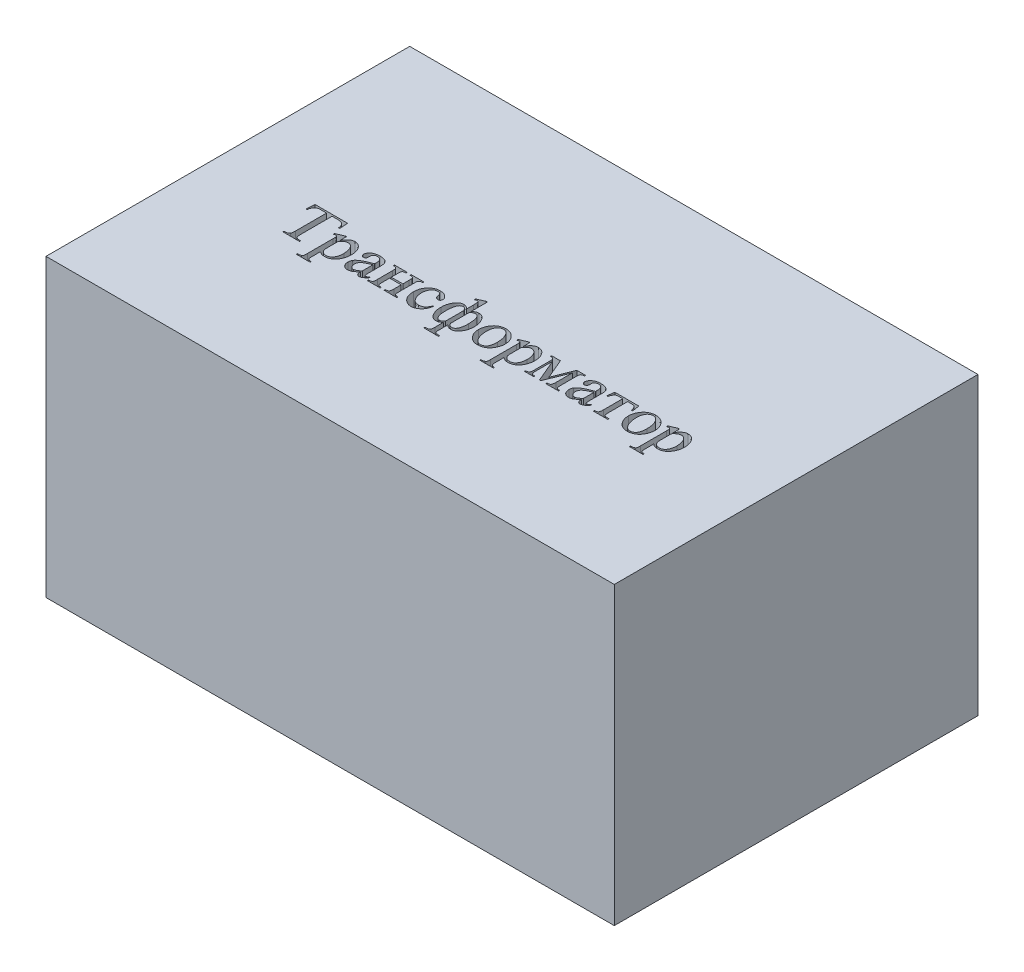
from build123d import *

# Parameters (mm, degrees)
SKETCH_1_W          = 50
SKETCH_1_H          = 32
EXTRUDE_1_DEPTH     = 26
CUT_EXTRUDE_1_DEPTH = 2


with BuildPart() as part:
    # Эскиз1 → Бобышка-Вытянуть1 (new body)
    with BuildSketch(Plane(origin=(0, 0, 0), x_dir=(1, 0, 0), z_dir=(0, 1, 0))):
        Rectangle(SKETCH_1_W, SKETCH_1_H)
    extrude(amount=EXTRUDE_1_DEPTH)

    # Эскиз2 → Вырез-Вытянуть1 (cut)
    # profile 1 of 13: a face of its own
    with BuildSketch(Plane(origin=(0, 26, 0), x_dir=(1, 0, 0), z_dir=(0, 1, 0))):
        with BuildLine():
            Line((-14.252306552, -0.212885814), (-14.203695441, -0.956483905))
            Line((-14.203695441, -0.956483905), (-14.300917663, -0.956483905))
            add(Edge.make_bspline(
                [(-14.300917663, -0.956483905), (-14.305847097, -0.922991165), (-14.314964851, -0.861041137), (-14.333101518, -0.776265282), (-14.353034055, -0.706191684), (-14.372094399, -0.666655385), (-14.380670268, -0.648866717)],
                knots=[0, 0, 0, 0, 1.272003444, 2.352768082, 3.258856713, 4, 4, 4, 4], degree=3))
            add(Edge.make_bspline(
                [(-14.380670268, -0.648866717), (-14.394934898, -0.62510683), (-14.422619963, -0.578993192), (-14.47478525, -0.518633747), (-14.533555451, -0.468011454), (-14.600236646, -0.427076526), (-14.675465949, -0.395471675), (-14.760925613, -0.373811457), (-14.85703807, -0.361229125), (-14.924720351, -0.359582478), (-14.960205858, -0.358719148)],
                knots=[0, 0, 0, 0, 0.969493434, 1.881611193, 2.781220507, 3.677324267, 4.611476311, 5.629159824, 6.756979455, 8, 8, 8, 8], degree=3))
            Line((-14.960205858, -0.358719148), (-15.46758433, -0.358719148))
            Line((-15.46758433, -0.358719148), (-15.46758433, -3.08094137))
            add(Edge.make_bspline(
                [(-15.46758433, -3.08094137), (-15.467620253, -3.107787441), (-15.467688415, -3.158725901), (-15.463338882, -3.23113017), (-15.458621212, -3.295824301), (-15.450786343, -3.35251857), (-15.442472062, -3.401824446), (-15.430084213, -3.442540127), (-15.417209162, -3.476374134), (-15.404859551, -3.494308273), (-15.399224955, -3.502490849)],
                knots=[0, 0, 0, 0, 1.48973486, 2.826663046, 4.025252461, 5.088590954, 6.003687083, 6.795186099, 7.45029523, 8, 8, 8, 8], degree=3))
            add(Edge.make_bspline(
                [(-15.399224955, -3.502490849), (-15.38151217, -3.519954739), (-15.34556047, -3.555401253), (-15.274752356, -3.591225014), (-15.19186587, -3.612561248), (-15.132264063, -3.614589975), (-15.100722351, -3.615663592)],
                knots=[0, 0, 0, 0, 0.902282073, 1.8313649, 2.852342462, 4, 4, 4, 4], degree=3))
            Line((-15.100722351, -3.615663592), (-14.981473219, -3.615663592))
            Line((-14.981473219, -3.615663592), (-14.981473219, -3.712885814))
            Line((-14.981473219, -3.712885814), (-16.439806552, -3.712885814))
            Line((-16.439806552, -3.712885814), (-16.439806552, -3.615663592))
            Line((-16.439806552, -3.615663592), (-16.318278775, -3.615663592))
            add(Edge.make_bspline(
                [(-16.318278775, -3.615663592), (-16.300779474, -3.615281591), (-16.266904706, -3.614542121), (-16.218150815, -3.607297958), (-16.173108735, -3.597242405), (-16.132123556, -3.581595704), (-16.094806311, -3.562158689), (-16.061671349, -3.537610128), (-16.033300101, -3.508152792), (-16.017253165, -3.486228428), (-16.00914249, -3.475147099)],
                knots=[0, 0, 0, 0, 1.182386838, 2.288838982, 3.326958154, 4.296765023, 5.246416275, 6.164047556, 7.072046332, 8, 8, 8, 8], degree=3))
            add(Edge.make_bspline(
                [(-16.00914249, -3.475147099), (-16.004615126, -3.466896169), (-15.994648524, -3.448732453), (-15.983618869, -3.416439556), (-15.975017711, -3.377110004), (-15.966493964, -3.33133183), (-15.960523708, -3.278294137), (-15.957416427, -3.218691958), (-15.953751673, -3.152126715), (-15.953714846, -3.105506617), (-15.953695441, -3.08094137)],
                knots=[0, 0, 0, 0, 0.561580455, 1.236271222, 2.028879402, 2.966584022, 4.017422664, 5.2149421, 6.532486222, 8, 8, 8, 8], degree=3))
            Line((-15.953695441, -3.08094137), (-15.953695441, -0.358719148))
            Line((-15.953695441, -0.358719148), (-16.376764018, -0.358719148))
            add(Edge.make_bspline(
                [(-16.376764018, -0.358719148), (-16.414762167, -0.359052352), (-16.485006316, -0.359668321), (-16.581570257, -0.366544596), (-16.661011165, -0.376227385), (-16.706764102, -0.389383074), (-16.726915927, -0.395177481)],
                knots=[0, 0, 0, 0, 1.290206054, 2.385101079, 3.288719717, 4, 4, 4, 4], degree=3))
            add(Edge.make_bspline(
                [(-16.726915927, -0.395177481), (-16.748830431, -0.404296858), (-16.79316844, -0.422747425), (-16.853638277, -0.465182215), (-16.909450597, -0.518307062), (-16.96047507, -0.5822567), (-17.00457877, -0.658029966), (-17.036251071, -0.747292706), (-17.061247269, -0.847459021), (-17.068150277, -0.919109739), (-17.071750997, -0.956483905)],
                knots=[0, 0, 0, 0, 0.8149513, 1.648831242, 2.524162633, 3.460481747, 4.455960915, 5.52585596, 6.709446718, 8, 8, 8, 8], degree=3))
            Line((-17.071750997, -0.956483905), (-17.168973219, -0.956483905))
            Line((-17.168973219, -0.956483905), (-17.120362108, -0.212885814))
            Line((-17.120362108, -0.212885814), (-14.252306552, -0.212885814))
        make_face()
    # profile 2 of 13: a face of its own
    with BuildSketch(Plane(origin=(0, 26, 0), x_dir=(1, 0, 0), z_dir=(0, 1, 0))):
        with BuildLine():
            Line((-14.057862108, -1.573996925), (-13.372749261, -1.282330259))
            Line((-13.372749261, -1.282330259), (-13.28008433, -1.282330259))
            Line((-13.28008433, -1.282330259), (-13.28008433, -1.856549009))
            add(Edge.make_bspline(
                [(-13.28008433, -1.856549009), (-13.250990871, -1.806943482), (-13.196114684, -1.713377358), (-13.106765385, -1.588509578), (-13.016381319, -1.48794872), (-12.925275722, -1.40937548), (-12.83193587, -1.352346205), (-12.736937067, -1.312263379), (-12.639893485, -1.286387603), (-12.573859732, -1.283677215), (-12.541043532, -1.282330259)],
                knots=[0, 0, 0, 0, 1.401999772, 2.644457052, 3.737195519, 4.692206544, 5.567942329, 6.392467073, 7.201118826, 8, 8, 8, 8], degree=3))
            add(Edge.make_bspline(
                [(-12.541043532, -1.282330259), (-12.512637763, -1.283241328), (-12.45654316, -1.285040471), (-12.374512394, -1.298209149), (-12.295922823, -1.319484985), (-12.221302489, -1.350082518), (-12.150168012, -1.389347804), (-12.082157201, -1.436303641), (-12.01875594, -1.493274154), (-11.980357146, -1.536150925), (-11.960748393, -1.558046405)],
                knots=[0, 0, 0, 0, 1.025601504, 2.025317838, 2.992513984, 3.960401479, 4.930273854, 5.922097126, 6.938896777, 8, 8, 8, 8], degree=3))
            add(Edge.make_bspline(
                [(-11.960748393, -1.558046405), (-11.937792149, -1.586682176), (-11.891779709, -1.644078402), (-11.834722083, -1.739293507), (-11.784644275, -1.83949924), (-11.745376697, -1.946960997), (-11.714394362, -2.060305572), (-11.691317198, -2.179832986), (-11.678643192, -2.305925709), (-11.676840717, -2.392003726), (-11.675917663, -2.436084599)],
                knots=[0, 0, 0, 0, 0.933423704, 1.870911632, 2.819349501, 3.782028158, 4.778179473, 5.808510833, 6.877730238, 8, 8, 8, 8], degree=3))
            add(Edge.make_bspline(
                [(-11.675917663, -2.436084599), (-11.676915712, -2.485495098), (-11.678871178, -2.582304516), (-11.694907379, -2.724423684), (-11.722548608, -2.859666936), (-11.759166816, -2.988947782), (-11.808596584, -3.110833214), (-11.866792989, -3.227042357), (-11.936980646, -3.336449316), (-11.991730308, -3.40349132), (-12.019233636, -3.437169668)],
                knots=[0, 0, 0, 0, 1.096005107, 2.14739012, 3.167445265, 4.155799957, 5.123737427, 6.080808703, 7.035900035, 8, 8, 8, 8], degree=3))
            add(Edge.make_bspline(
                [(-12.019233636, -3.437169668), (-12.04302955, -3.463001037), (-12.089838886, -3.513814347), (-12.167769933, -3.580115442), (-12.250388959, -3.636011902), (-12.337509844, -3.681835185), (-12.429097759, -3.717983139), (-12.525567058, -3.742737878), (-12.626359765, -3.758434321), (-12.695172993, -3.760464423), (-12.730171136, -3.761496925)],
                knots=[0, 0, 0, 0, 1.043566166, 2.052816222, 3.034165311, 4.003983239, 4.974180932, 5.954721185, 6.959779086, 8, 8, 8, 8], degree=3))
            add(Edge.make_bspline(
                [(-12.730171136, -3.761496925), (-12.760337456, -3.761051431), (-12.818566817, -3.760191505), (-12.902570392, -3.749728453), (-12.980733575, -3.734761858), (-13.029334177, -3.718001738), (-13.052979295, -3.70984762)],
                knots=[0, 0, 0, 0, 1.100835058, 2.124916899, 3.087736362, 4, 4, 4, 4], degree=3))
            add(Edge.make_bspline(
                [(-13.052979295, -3.70984762), (-13.070696753, -3.702745718), (-13.108162304, -3.687727951), (-13.162484287, -3.653297699), (-13.221620368, -3.612782156), (-13.259887293, -3.579867391), (-13.28008433, -3.562495189)],
                knots=[0, 0, 0, 0, 0.840033881, 1.776345761, 2.826369563, 4, 4, 4, 4], degree=3))
            Line((-13.28008433, -3.562495189), (-13.28008433, -4.296219148))
            add(Edge.make_bspline(
                [(-13.28008433, -4.296219148), (-13.279799093, -4.331659287), (-13.279283328, -4.395742055), (-13.275700196, -4.481339775), (-13.267496947, -4.5454587), (-13.257858405, -4.592248997), (-13.240664856, -4.625134676), (-13.221243635, -4.65276564), (-13.196837071, -4.67685378), (-13.166800419, -4.698899579), (-13.126431821, -4.714671133), (-13.075363682, -4.726450185), (-13.011599508, -4.732629723), (-12.965134904, -4.733334802), (-12.939806552, -4.733719148)],
                knots=[0, 0, 0, 0, 1.905250359, 3.445068729, 4.597861324, 5.383336025, 5.991883834, 6.577166375, 7.19297346, 7.827295159, 8.565245636, 9.502587067, 10.63863353, 12, 12, 12, 12], degree=3))
            Line((-12.939806552, -4.733719148), (-12.939806552, -4.83094137))
            Line((-12.939806552, -4.83094137), (-14.15508433, -4.83094137))
            Line((-14.15508433, -4.83094137), (-14.15508433, -4.733719148))
            Line((-14.15508433, -4.733719148), (-14.085965407, -4.733719148))
            add(Edge.make_bspline(
                [(-14.085965407, -4.733719148), (-14.061623895, -4.733495195), (-14.014522684, -4.733061844), (-13.946800388, -4.723708338), (-13.884078565, -4.708519549), (-13.846240191, -4.691271869), (-13.827718879, -4.682829391)],
                knots=[0, 0, 0, 0, 1.098428261, 2.125476155, 3.082448889, 4, 4, 4, 4], degree=3))
            add(Edge.make_bspline(
                [(-13.827718879, -4.682829391), (-13.811432423, -4.672138521), (-13.777821172, -4.650075187), (-13.751393064, -4.61043408), (-13.738597116, -4.577924531), (-13.732739686, -4.55445674), (-13.728745677, -4.525130653), (-13.723722933, -4.490535423), (-13.721230172, -4.449921195), (-13.718615096, -4.403854846), (-13.718431688, -4.351915322), (-13.717877052, -4.315459516), (-13.71758433, -4.296219148)],
                knots=[0, 0, 0, 0, 1.370447564, 2.828267844, 3.27129719, 3.845584882, 4.535663283, 5.367788551, 6.321192185, 7.416716427, 8.636614219, 10, 10, 10, 10], degree=3))
            Line((-13.71758433, -4.296219148), (-13.71758433, -2.011496925))
            add(Edge.make_bspline(
                [(-13.71758433, -2.011496925), (-13.717493005, -1.980343147), (-13.717328082, -1.924083247), (-13.721591993, -1.84940938), (-13.725498999, -1.793076195), (-13.73588934, -1.744612869), (-13.755429658, -1.700829391), (-13.790057934, -1.661664207), (-13.839504515, -1.637818976), (-13.876547058, -1.635843124), (-13.896837802, -1.634760814)],
                knots=[0, 0, 0, 0, 1.567526531, 2.830760559, 3.765317645, 4.405299966, 5.317609831, 6.147419258, 6.985214361, 8, 8, 8, 8], degree=3))
            add(Edge.make_bspline(
                [(-13.896837802, -1.634760814), (-13.906237114, -1.635269824), (-13.926512436, -1.636367814), (-13.958332346, -1.643739809), (-13.993789824, -1.65546368), (-14.018182826, -1.665715555), (-14.031277907, -1.671219148)],
                knots=[0, 0, 0, 0, 0.80463011, 1.735673361, 2.784424338, 4, 4, 4, 4], degree=3))
            Line((-14.031277907, -1.671219148), (-14.057862108, -1.573996925))
        make_face()
        with BuildLine():
            Line((-13.28008433, -2.006180085), (-13.28008433, -2.874344148))
            add(Edge.make_bspline(
                [(-13.28008433, -2.874344148), (-13.280253479, -2.896880051), (-13.280576619, -2.93993241), (-13.27839114, -3.001435078), (-13.277688787, -3.056687668), (-13.273976395, -3.106004899), (-13.271457212, -3.149363176), (-13.267583162, -3.186846898), (-13.263378431, -3.21809796), (-13.259181373, -3.23666955), (-13.257297872, -3.24500387)],
                knots=[0, 0, 0, 0, 1.453832287, 2.777386296, 3.970302931, 5.017795271, 5.967486994, 6.772067861, 7.448944383, 8, 8, 8, 8], degree=3))
            add(Edge.make_bspline(
                [(-13.257297872, -3.24500387), (-13.250098991, -3.269169799), (-13.235597929, -3.317848424), (-13.196589952, -3.385503464), (-13.146174659, -3.449019749), (-13.08318676, -3.506224986), (-13.009698173, -3.555705563), (-12.924904194, -3.590196847), (-12.831564026, -3.612391791), (-12.766257732, -3.614547578), (-12.732449782, -3.615663592)],
                knots=[0, 0, 0, 0, 0.871466033, 1.755437064, 2.68609854, 3.673774775, 4.693678789, 5.740085978, 6.830081197, 8, 8, 8, 8], degree=3))
            add(Edge.make_bspline(
                [(-12.732449782, -3.615663592), (-12.711663101, -3.615073787), (-12.670894855, -3.613917021), (-12.611330015, -3.605031693), (-12.555370516, -3.588323578), (-12.501645974, -3.567551814), (-12.451375973, -3.53895373), (-12.40403679, -3.504535837), (-12.359548076, -3.464134504), (-12.333350819, -3.433179374), (-12.320014886, -3.417421405)],
                knots=[0, 0, 0, 0, 1.051390791, 2.062058809, 3.034855595, 4.000375553, 4.969371512, 5.950478289, 6.956673762, 8, 8, 8, 8], degree=3))
            add(Edge.make_bspline(
                [(-12.320014886, -3.417421405), (-12.303275479, -3.394988681), (-12.269502105, -3.349728488), (-12.22798779, -3.274143428), (-12.192114687, -3.19290041), (-12.163476619, -3.104751223), (-12.140491454, -3.010346017), (-12.125121924, -2.908924584), (-12.11482147, -2.801134498), (-12.113893484, -2.727017431), (-12.113417663, -2.689014287)],
                knots=[0, 0, 0, 0, 0.869853677, 1.75501408, 2.675529462, 3.629506124, 4.634379492, 5.694942312, 6.818093514, 8, 8, 8, 8], degree=3))
            add(Edge.make_bspline(
                [(-12.113417663, -2.689014287), (-12.114185571, -2.645952812), (-12.115683162, -2.561973388), (-12.1261514, -2.439871061), (-12.144228721, -2.325332781), (-12.169899955, -2.218563559), (-12.203206004, -2.119654981), (-12.243805486, -2.028346554), (-12.290996721, -1.944336247), (-12.32930061, -1.894127444), (-12.348118184, -1.869461335)],
                knots=[0, 0, 0, 0, 1.188963164, 2.318741806, 3.380711152, 4.387882928, 5.347341123, 6.258035462, 7.144224026, 8, 8, 8, 8], degree=3))
            add(Edge.make_bspline(
                [(-12.348118184, -1.869461335), (-12.361771269, -1.853764316), (-12.388362504, -1.823192238), (-12.431967047, -1.782513255), (-12.477672881, -1.748379755), (-12.524906602, -1.719526043), (-12.575050086, -1.698536529), (-12.626519616, -1.682172234), (-12.6802206, -1.672990934), (-12.71646715, -1.671812734), (-12.734728427, -1.671219148)],
                knots=[0, 0, 0, 0, 1.109462978, 2.160829832, 3.173926553, 4.149215964, 5.105231967, 6.066577187, 7.02592742, 8, 8, 8, 8], degree=3))
            add(Edge.make_bspline(
                [(-12.734728427, -1.671219148), (-12.755038699, -1.671952009), (-12.795972934, -1.673429052), (-12.857114765, -1.685538369), (-12.918212486, -1.704175775), (-12.957222542, -1.722620374), (-12.977024434, -1.731983037)],
                knots=[0, 0, 0, 0, 0.966401269, 1.947728537, 2.95824662, 4, 4, 4, 4], degree=3))
            add(Edge.make_bspline(
                [(-12.977024434, -1.731983037), (-12.985478338, -1.73663541), (-13.003971925, -1.746812846), (-13.032282148, -1.767451247), (-13.064599085, -1.792874483), (-13.100486352, -1.824696803), (-13.140703728, -1.861453699), (-13.183650408, -1.90514163), (-13.230839077, -1.953661165), (-13.263177686, -1.988149541), (-13.28008433, -2.006180085)],
                knots=[0, 0, 0, 0, 0.564123834, 1.234065678, 2.046171616, 2.970157313, 4.039481302, 5.233690196, 6.553771558, 8, 8, 8, 8], degree=3))
        make_face(mode=Mode.SUBTRACT)
    # profile 3 of 13: a face of its own
    with BuildSketch(Plane(origin=(0, 26, 0), x_dir=(1, 0, 0), z_dir=(0, 1, 0))):
        with BuildLine():
            add(Edge.make_bspline(
                [(-9.974528775, -3.374886682), (-10.003321712, -3.397006539), (-10.057935057, -3.438962639), (-10.136426784, -3.497019121), (-10.205359586, -3.549360799), (-10.266742163, -3.592922049), (-10.319440973, -3.629975059), (-10.363863365, -3.659171185), (-10.399425983, -3.681966179), (-10.421072783, -3.693009111), (-10.430257941, -3.697694842)],
                knots=[0, 0, 0, 0, 1.558875, 2.95681467, 4.191698034, 5.274657479, 6.188356203, 6.95716577, 7.557505181, 8, 8, 8, 8], degree=3))
            add(Edge.make_bspline(
                [(-10.430257941, -3.697694842), (-10.453592538, -3.707667714), (-10.500114524, -3.727550544), (-10.573561752, -3.746521224), (-10.648785955, -3.759665936), (-10.699838214, -3.760880916), (-10.725722351, -3.761496925)],
                knots=[0, 0, 0, 0, 0.998482016, 1.990665029, 2.981241918, 4, 4, 4, 4], degree=3))
            add(Edge.make_bspline(
                [(-10.725722351, -3.761496925), (-10.745743409, -3.760801519), (-10.784915476, -3.759440925), (-10.842538884, -3.752036111), (-10.897263885, -3.738292172), (-10.949023323, -3.719079112), (-10.998511394, -3.695546049), (-11.044809432, -3.665483071), (-11.089034327, -3.630613244), (-11.129900448, -3.590275702), (-11.166994135, -3.545871646), (-11.198868037, -3.49750863), (-11.226984526, -3.446270283), (-11.248201213, -3.390834406), (-11.266365843, -3.332627879), (-11.277905987, -3.270929044), (-11.286054108, -3.205978684), (-11.286698427, -3.161481237), (-11.287028775, -3.138667064)],
                knots=[0, 0, 0, 0, 1.021269733, 1.99815853, 2.956354521, 3.891750869, 4.809880197, 5.744652621, 6.700410006, 7.677298803, 8.667491899, 9.645063, 10.627057522, 11.641202316, 12.666381854, 13.732374063, 14.837371315, 16, 16, 16, 16], degree=3))
            add(Edge.make_bspline(
                [(-11.287028775, -3.138667064), (-11.286394868, -3.109960616), (-11.285162186, -3.054138657), (-11.268670188, -2.974089487), (-11.246494766, -2.898805916), (-11.221782164, -2.85398567), (-11.209554816, -2.831809425)],
                knots=[0, 0, 0, 0, 1.073591545, 2.087683635, 3.053820535, 4, 4, 4, 4], degree=3))
            add(Edge.make_bspline(
                [(-11.209554816, -2.831809425), (-11.189673752, -2.801750173), (-11.147916712, -2.738615454), (-11.063736752, -2.653489385), (-10.961729449, -2.570311161), (-10.861979915, -2.504802368), (-10.770084612, -2.451102913), (-10.687968318, -2.409290858), (-10.595514134, -2.364292438), (-10.492847834, -2.316267193), (-10.378095211, -2.268131803), (-10.253320401, -2.216626718), (-10.117870694, -2.162247178), (-10.023472189, -2.126996038), (-9.974528775, -2.108719148)],
                knots=[0, 0, 0, 0, 0.890335071, 1.870008429, 2.947759746, 4.145438777, 4.819447813, 5.581919563, 6.425634938, 7.365025325, 8.387143385, 9.505655779, 10.706740942, 12, 12, 12, 12], degree=3))
            Line((-9.974528775, -2.108719148), (-9.974528775, -2.01985196))
            add(Edge.make_bspline(
                [(-9.974528775, -2.01985196), (-9.974758074, -1.992755398), (-9.975200022, -1.940529982), (-9.980283442, -1.865411604), (-9.989868293, -1.797103952), (-10.000241013, -1.73504658), (-10.016560904, -1.680312748), (-10.03530303, -1.631715868), (-10.057965532, -1.589783058), (-10.09242366, -1.54297946), (-10.14529632, -1.495874114), (-10.221294114, -1.455494063), (-10.310112547, -1.431701297), (-10.37339277, -1.429383821), (-10.406711934, -1.428163592)],
                knots=[0, 0, 0, 0, 1.156239016, 2.228513829, 3.209486664, 4.099496727, 4.909803097, 5.642093741, 6.318967722, 6.93697649, 8.115067704, 9.304155298, 10.580547167, 12, 12, 12, 12], degree=3))
            add(Edge.make_bspline(
                [(-10.406711934, -1.428163592), (-10.432155745, -1.428977738), (-10.480869191, -1.43053646), (-10.549613287, -1.448102377), (-10.611213521, -1.474536217), (-10.644722418, -1.5020261), (-10.661160719, -1.515511682)],
                knots=[0, 0, 0, 0, 1.106638015, 2.118713769, 3.077106298, 4, 4, 4, 4], degree=3))
            add(Edge.make_bspline(
                [(-10.661160719, -1.515511682), (-10.676057723, -1.529854215), (-10.704523936, -1.557260908), (-10.734669941, -1.606927632), (-10.754233361, -1.659403122), (-10.756491653, -1.696115209), (-10.757623393, -1.714513418)],
                knots=[0, 0, 0, 0, 1.084622452, 2.072570699, 3.034071598, 4, 4, 4, 4], degree=3))
            Line((-10.757623393, -1.714513418), (-10.752306552, -1.863384946))
            add(Edge.make_bspline(
                [(-10.752306552, -1.863384946), (-10.752931837, -1.881940864), (-10.754118856, -1.917166773), (-10.76581391, -1.966798465), (-10.784364034, -2.010186218), (-10.811860799, -2.045690116), (-10.844512534, -2.074243122), (-10.883055224, -2.094349396), (-10.926217078, -2.106949389), (-10.956787715, -2.108116436), (-10.97257565, -2.108719148)],
                knots=[0, 0, 0, 0, 1.192988088, 2.264727143, 3.264608775, 4.207008523, 5.131898225, 6.036298471, 6.985863792, 8, 8, 8, 8], degree=3))
            add(Edge.make_bspline(
                [(-10.97257565, -2.108719148), (-10.987897274, -2.10822393), (-11.01762561, -2.107263067), (-11.05929376, -2.093008454), (-11.09787435, -2.073624553), (-11.130263314, -2.044060766), (-11.157569527, -2.00803876), (-11.176189995, -1.964755056), (-11.187955979, -1.915909149), (-11.189170589, -1.881435277), (-11.189806552, -1.863384946)],
                knots=[0, 0, 0, 0, 0.992015986, 1.924794819, 2.838757396, 3.784255213, 4.749783075, 5.760236574, 6.827272098, 8, 8, 8, 8], degree=3))
            add(Edge.make_bspline(
                [(-11.189806552, -1.863384946), (-11.18904396, -1.845352122), (-11.187527024, -1.809481525), (-11.176236982, -1.756440751), (-11.159017239, -1.704390123), (-11.133230889, -1.653965528), (-11.10106348, -1.60443344), (-11.062245322, -1.555497399), (-11.015476289, -1.508667515), (-10.96248007, -1.46301004), (-10.902891821, -1.42077557), (-10.837384724, -1.38335014), (-10.765778104, -1.352057064), (-10.688720809, -1.326495277), (-10.605587358, -1.306744897), (-10.517011171, -1.292416423), (-10.422564841, -1.284177956), (-10.357863561, -1.282956631), (-10.324680684, -1.282330259)],
                knots=[0, 0, 0, 0, 0.751350949, 1.494574915, 2.252349993, 3.031299287, 3.848234099, 4.712108084, 5.630260355, 6.603499815, 7.625714709, 8.670571574, 9.743474444, 10.878456939, 12.051105368, 13.302367809, 14.616484898, 16, 16, 16, 16], degree=3))
            add(Edge.make_bspline(
                [(-10.324680684, -1.282330259), (-10.274472404, -1.283582268), (-10.178194097, -1.285983094), (-10.041117917, -1.30570184), (-9.917292566, -1.33780125), (-9.84371561, -1.372615779), (-9.808187629, -1.389426613)],
                knots=[0, 0, 0, 0, 1.131049808, 2.168876517, 3.115808485, 4, 4, 4, 4], degree=3))
            add(Edge.make_bspline(
                [(-9.808187629, -1.389426613), (-9.783768897, -1.404012892), (-9.735146288, -1.433057108), (-9.672850936, -1.492324743), (-9.62124579, -1.563097511), (-9.596174355, -1.616555123), (-9.58336124, -1.643875398)],
                knots=[0, 0, 0, 0, 0.983173165, 1.957695623, 2.956251224, 4, 4, 4, 4], degree=3))
            add(Edge.make_bspline(
                [(-9.58336124, -1.643875398), (-9.579682089, -1.654464942), (-9.571629131, -1.677643425), (-9.561545273, -1.716889032), (-9.554927698, -1.763806206), (-9.547479852, -1.817637595), (-9.543668467, -1.879061634), (-9.539591215, -1.947648695), (-9.537437074, -2.023890125), (-9.537169109, -2.077070458), (-9.537028775, -2.104921405)],
                knots=[0, 0, 0, 0, 0.578071798, 1.265288381, 2.085304142, 3.019791722, 4.067310373, 5.257317904, 6.563636446, 8, 8, 8, 8], degree=3))
            Line((-9.537028775, -2.104921405), (-9.537028775, -2.919917064))
            add(Edge.make_bspline(
                [(-9.537028775, -2.919917064), (-9.537117153, -2.947261431), (-9.537284095, -2.99891322), (-9.536176557, -3.072331316), (-9.535860377, -3.137160348), (-9.533955343, -3.193858518), (-9.532909144, -3.242249641), (-9.53031959, -3.282482171), (-9.528484272, -3.31444993), (-9.524679975, -3.344738949), (-9.518070265, -3.373948257), (-9.509510316, -3.403307855), (-9.498128882, -3.426397721), (-9.481589598, -3.448898165), (-9.453564926, -3.465319908), (-9.42961142, -3.46833899), (-9.417779643, -3.469830259)],
                knots=[0, 0, 0, 0, 1.895498962, 3.580478337, 5.089959178, 6.389201248, 7.513008224, 8.444695769, 9.183712318, 9.732301295, 10.558500312, 11.257899372, 11.846575001, 12.334540979, 13.177350527, 14, 14, 14, 14], degree=3))
            add(Edge.make_bspline(
                [(-9.417779643, -3.469830259), (-9.405183633, -3.469078096), (-9.381119801, -3.467641139), (-9.35913687, -3.457806818), (-9.348660719, -3.453120189)],
                knots=[0, 0, 0, 0, 1.04688317, 2, 2, 2, 2], degree=3))
            add(Edge.make_bspline(
                [(-9.348660719, -3.453120189), (-9.33787516, -3.445718877), (-9.311087664, -3.427336647), (-9.268439426, -3.388248354), (-9.211288987, -3.337661432), (-9.170713479, -3.297647168), (-9.148139886, -3.275385814)],
                knots=[0, 0, 0, 0, 0.584543641, 1.451798638, 2.582345273, 4, 4, 4, 4], degree=3))
            Line((-9.148139886, -3.275385814), (-9.148139886, -3.411345016))
            add(Edge.make_bspline(
                [(-9.148139886, -3.411345016), (-9.171590152, -3.438998949), (-9.216697687, -3.492192405), (-9.28724471, -3.563848217), (-9.357409102, -3.624251283), (-9.426388094, -3.674311847), (-9.495118641, -3.712569069), (-9.56275874, -3.740583288), (-9.63003761, -3.758449268), (-9.675164529, -3.760494164), (-9.697293532, -3.761496925)],
                knots=[0, 0, 0, 0, 1.29495671, 2.490901519, 3.587659578, 4.59909354, 5.530268421, 6.390197302, 7.210596943, 8, 8, 8, 8], degree=3))
            add(Edge.make_bspline(
                [(-9.697293532, -3.761496925), (-9.717434943, -3.76065906), (-9.756210826, -3.759046016), (-9.810907025, -3.741407299), (-9.859036034, -3.713675861), (-9.901010834, -3.674296054), (-9.934465082, -3.620417772), (-9.956584134, -3.551433158), (-9.972145641, -3.468231191), (-9.973692644, -3.407636925), (-9.974528775, -3.374886682)],
                knots=[0, 0, 0, 0, 0.892412594, 1.718056717, 2.524775051, 3.344648327, 4.249949684, 5.310413251, 6.546320934, 8, 8, 8, 8], degree=3))
        make_face()
        with BuildLine():
            Line((-9.974528775, -3.199430953), (-9.974528775, -2.254552481))
            add(Edge.make_bspline(
                [(-9.974528775, -2.254552481), (-10.005406498, -2.267742172), (-10.064135278, -2.292828687), (-10.148252397, -2.328314744), (-10.223255354, -2.36193092), (-10.289984625, -2.39201075), (-10.347910177, -2.41948973), (-10.397306201, -2.443753872), (-10.438452324, -2.464813554), (-10.462702914, -2.478550179), (-10.473552212, -2.48469571)],
                knots=[0, 0, 0, 0, 1.465697383, 2.787725602, 3.985057731, 5.053380534, 5.982790254, 6.783498627, 7.455758124, 8, 8, 8, 8], degree=3))
            add(Edge.make_bspline(
                [(-10.473552212, -2.48469571), (-10.505377081, -2.504062136), (-10.565735534, -2.540792138), (-10.645332745, -2.603054977), (-10.711657589, -2.665733379), (-10.763339356, -2.73111066), (-10.80272644, -2.7985476), (-10.828724073, -2.869133773), (-10.846909029, -2.942297315), (-10.848647525, -2.992467417), (-10.849528775, -3.017898835)],
                knots=[0, 0, 0, 0, 1.302370349, 2.470051283, 3.52876103, 4.487475757, 5.376328791, 6.248248042, 7.112030167, 8, 8, 8, 8], degree=3))
            add(Edge.make_bspline(
                [(-10.849528775, -3.017898835), (-10.848340239, -3.049165625), (-10.846050791, -3.109394109), (-10.824832904, -3.195938388), (-10.78984546, -3.27399074), (-10.741947384, -3.342124735), (-10.685717937, -3.398240023), (-10.623473121, -3.439774827), (-10.556108357, -3.464714842), (-10.509699913, -3.468123594), (-10.486464538, -3.469830259)],
                knots=[0, 0, 0, 0, 1.168223595, 2.250321665, 3.310218344, 4.350849945, 5.348877238, 6.265796639, 7.13173418, 8, 8, 8, 8], degree=3))
            add(Edge.make_bspline(
                [(-10.486464538, -3.469830259), (-10.469443133, -3.468768534), (-10.43400548, -3.466558081), (-10.379034272, -3.453627548), (-10.320716804, -3.431864847), (-10.258425919, -3.402144781), (-10.192865952, -3.363339317), (-10.122834344, -3.317114067), (-10.049598913, -3.261371864), (-10.000209801, -3.220620553), (-9.974528775, -3.199430953)],
                knots=[0, 0, 0, 0, 0.693887409, 1.444636304, 2.289794561, 3.226439617, 4.252586567, 5.391242417, 6.643515343, 8, 8, 8, 8], degree=3))
        make_face(mode=Mode.SUBTRACT)
    # profile 4 of 13: a face of its own
    with BuildSketch(Plane(origin=(0, 26, 0), x_dir=(1, 0, 0), z_dir=(0, 1, 0))):
        with BuildLine():
            Line((-8.224528775, -2.400385814), (-7.203695441, -2.400385814))
            Line((-7.203695441, -2.400385814), (-7.203695441, -1.865663592))
            add(Edge.make_bspline(
                [(-7.203695441, -1.865663592), (-7.203626709, -1.832995008), (-7.203501969, -1.773706385), (-7.207606365, -1.694187457), (-7.212062377, -1.633225079), (-7.219435715, -1.587952166), (-7.231299843, -1.552788679), (-7.250406196, -1.523477726), (-7.275211144, -1.496806347), (-7.306174733, -1.471181189), (-7.348248643, -1.451459851), (-7.402136031, -1.437281437), (-7.468829776, -1.429855763), (-7.517626593, -1.428756897), (-7.543973219, -1.428163592)],
                knots=[0, 0, 0, 0, 1.755383208, 3.185759555, 4.278495852, 5.039162179, 5.646019468, 6.257587626, 6.902890959, 7.599920358, 8.40320705, 9.377050097, 10.583803534, 12, 12, 12, 12], degree=3))
            Line((-7.543973219, -1.428163592), (-7.543973219, -1.33094137))
            Line((-7.543973219, -1.33094137), (-6.425917663, -1.33094137))
            Line((-6.425917663, -1.33094137), (-6.425917663, -1.428163592))
            add(Edge.make_bspline(
                [(-6.425917663, -1.428163592), (-6.449467652, -1.428653913), (-6.49336615, -1.429567898), (-6.554337129, -1.434740149), (-6.605012084, -1.44619361), (-6.64650408, -1.46105893), (-6.679536177, -1.480937439), (-6.707054386, -1.503683175), (-6.727607337, -1.531856602), (-6.744604918, -1.565916517), (-6.754548398, -1.613323518), (-6.761405764, -1.67835467), (-6.765547758, -1.764854827), (-6.765964443, -1.829709877), (-6.766195441, -1.865663592)],
                knots=[0, 0, 0, 0, 1.263351912, 2.354958694, 3.273916767, 4.043047933, 4.706674289, 5.332559974, 5.943541481, 6.562913514, 7.359825143, 8.521860562, 10.071822691, 12, 12, 12, 12], degree=3))
            Line((-6.766195441, -1.865663592), (-6.766195441, -3.178163592))
            add(Edge.make_bspline(
                [(-6.766195441, -3.178163592), (-6.765767723, -3.210819578), (-6.764991652, -3.2700721), (-6.762892276, -3.350240228), (-6.75666758, -3.412015448), (-6.750084304, -3.458853381), (-6.736900783, -3.49477897), (-6.717655571, -3.525063532), (-6.690629049, -3.550741853), (-6.65856583, -3.575630713), (-6.615238655, -3.593609151), (-6.562097516, -3.606961028), (-6.497479922, -3.613795006), (-6.450993972, -3.615008816), (-6.425917663, -3.615663592)],
                knots=[0, 0, 0, 0, 1.755540165, 3.185332866, 4.306421081, 5.093877349, 5.718179628, 6.348532491, 7.002811195, 7.713128056, 8.517220513, 9.50071166, 10.651787759, 12, 12, 12, 12], degree=3))
            Line((-6.425917663, -3.615663592), (-6.425917663, -3.712885814))
            Line((-6.425917663, -3.712885814), (-7.543973219, -3.712885814))
            Line((-7.543973219, -3.712885814), (-7.543973219, -3.615663592))
            add(Edge.make_bspline(
                [(-7.543973219, -3.615663592), (-7.512754819, -3.615065124), (-7.455483133, -3.613967204), (-7.378089556, -3.599729349), (-7.316312135, -3.578066448), (-7.276484896, -3.549111719), (-7.25444235, -3.51830916), (-7.241202752, -3.48873054), (-7.229197703, -3.453149442), (-7.219230797, -3.410980113), (-7.213053993, -3.36208177), (-7.207801291, -3.306610226), (-7.203653767, -3.244556678), (-7.203681134, -3.200957569), (-7.203695441, -3.178163592)],
                knots=[0, 0, 0, 0, 1.690346571, 3.101023719, 4.248137943, 5.217279308, 5.708751061, 6.285910337, 6.967405867, 7.743156262, 8.630285284, 9.636903878, 10.764553721, 12, 12, 12, 12], degree=3))
            Line((-7.203695441, -3.178163592), (-7.203695441, -2.546219148))
            Line((-7.203695441, -2.546219148), (-8.224528775, -2.546219148))
            Line((-8.224528775, -2.546219148), (-8.224528775, -3.178163592))
            add(Edge.make_bspline(
                [(-8.224528775, -3.178163592), (-8.224101056, -3.210819578), (-8.223324985, -3.2700721), (-8.22122561, -3.350240228), (-8.215000913, -3.412015448), (-8.208417637, -3.458853381), (-8.195234116, -3.49477897), (-8.175988904, -3.525063532), (-8.148962383, -3.550741853), (-8.116899163, -3.575630713), (-8.073571988, -3.593609151), (-8.020430849, -3.606961028), (-7.955813255, -3.613795006), (-7.909327306, -3.615008816), (-7.884250997, -3.615663592)],
                knots=[0, 0, 0, 0, 1.755540165, 3.185332866, 4.306421081, 5.093877349, 5.718179628, 6.348532491, 7.002811195, 7.713128056, 8.517220513, 9.50071166, 10.651787759, 12, 12, 12, 12], degree=3))
            Line((-7.884250997, -3.615663592), (-7.884250997, -3.712885814))
            Line((-7.884250997, -3.712885814), (-9.002306552, -3.712885814))
            Line((-9.002306552, -3.712885814), (-9.002306552, -3.615663592))
            add(Edge.make_bspline(
                [(-9.002306552, -3.615663592), (-8.984829921, -3.615342159), (-8.951605282, -3.614731086), (-8.904417554, -3.611006883), (-8.862292881, -3.604956805), (-8.824767656, -3.596949), (-8.792102051, -3.585692511), (-8.764327916, -3.571852914), (-8.740777384, -3.556206203), (-8.722742638, -3.53602006), (-8.707449193, -3.512078456), (-8.696119444, -3.482176514), (-8.685256537, -3.446705954), (-8.67635919, -3.405044063), (-8.669646929, -3.35707393), (-8.665461433, -3.30278666), (-8.662191426, -3.242511498), (-8.662084465, -3.200195807), (-8.662028775, -3.178163592)],
                knots=[0, 0, 0, 0, 1.258720138, 2.392939594, 3.406399757, 4.322135718, 5.152563947, 5.886494953, 6.554242216, 7.173684194, 7.821207301, 8.589879974, 9.46666201, 10.493161759, 11.65360857, 12.952884252, 14.413479575, 16, 16, 16, 16], degree=3))
            Line((-8.662028775, -3.178163592), (-8.662028775, -1.865663592))
            add(Edge.make_bspline(
                [(-8.662028775, -1.865663592), (-8.661939493, -1.832740378), (-8.66177802, -1.773195994), (-8.666096881, -1.692934809), (-8.67018068, -1.630888558), (-8.678368434, -1.584305293), (-8.691250764, -1.548257198), (-8.710640694, -1.518090679), (-8.737407266, -1.491946035), (-8.770815658, -1.468773979), (-8.81309175, -1.448979017), (-8.866624374, -1.437444267), (-8.930616801, -1.428676179), (-8.977199265, -1.428343111), (-9.002306552, -1.428163592)],
                knots=[0, 0, 0, 0, 1.767708752, 3.19704909, 4.316087644, 5.105437368, 5.729287917, 6.359184671, 7.012989955, 7.725911732, 8.535040188, 9.501313979, 10.653243702, 12, 12, 12, 12], degree=3))
            Line((-9.002306552, -1.428163592), (-9.002306552, -1.33094137))
            Line((-9.002306552, -1.33094137), (-7.884250997, -1.33094137))
            Line((-7.884250997, -1.33094137), (-7.884250997, -1.428163592))
            add(Edge.make_bspline(
                [(-7.884250997, -1.428163592), (-7.907800986, -1.428653913), (-7.951699483, -1.429567898), (-8.012670462, -1.434740149), (-8.063345417, -1.44619361), (-8.104837413, -1.46105893), (-8.13786951, -1.480937439), (-8.165387719, -1.503683175), (-8.18594067, -1.531856602), (-8.202938251, -1.565916517), (-8.212881731, -1.613323518), (-8.219739098, -1.67835467), (-8.223881091, -1.764854827), (-8.224297777, -1.829709877), (-8.224528775, -1.865663592)],
                knots=[0, 0, 0, 0, 1.263351912, 2.354958694, 3.273916767, 4.043047933, 4.706674289, 5.332559974, 5.943541481, 6.562913514, 7.359825143, 8.521860562, 10.071822691, 12, 12, 12, 12], degree=3))
            Line((-8.224528775, -1.865663592), (-8.224528775, -2.400385814))
        make_face()
    # profile 5 of 13: a face of its own
    with BuildSketch(Plane(origin=(0, 26, 0), x_dir=(1, 0, 0), z_dir=(0, 1, 0))):
        with BuildLine():
            add(Edge.make_bspline(
                [(-4.141195441, -2.775602828), (-4.149475491, -2.815999579), (-4.165593808, -2.894637711), (-4.198846803, -3.007355763), (-4.236468548, -3.112667186), (-4.280367696, -3.210128143), (-4.330578506, -3.299276589), (-4.386336272, -3.38030318), (-4.447249566, -3.453890862), (-4.513981392, -3.518989363), (-4.584784373, -3.575579034), (-4.657138333, -3.625564364), (-4.731731462, -3.667308422), (-4.808127174, -3.70191862), (-4.886517971, -3.728492384), (-4.966849082, -3.747592597), (-5.049014707, -3.759326344), (-5.104518242, -3.760771032), (-5.132406379, -3.761496925)],
                knots=[0, 0, 0, 0, 1.297413908, 2.525604275, 3.695291166, 4.815162201, 5.885657823, 6.91131488, 7.907158975, 8.887708176, 9.839801015, 10.757107347, 11.652659607, 12.526533963, 13.393440414, 14.25358095, 15.122499594, 16, 16, 16, 16], degree=3))
            add(Edge.make_bspline(
                [(-5.132406379, -3.761496925), (-5.165389046, -3.760501828), (-5.23098353, -3.758522822), (-5.327446711, -3.741843319), (-5.42088546, -3.716356682), (-5.510618757, -3.679082802), (-5.597438621, -3.632112783), (-5.680425446, -3.573593458), (-5.760596011, -3.505577099), (-5.836884615, -3.42796984), (-5.906705918, -3.340900082), (-5.967399722, -3.245482115), (-6.019722383, -3.143215135), (-6.060917025, -3.032863584), (-6.095051625, -2.916022051), (-6.116758481, -2.791161309), (-6.132086344, -2.659773445), (-6.133518643, -2.569560052), (-6.134250997, -2.523432689)],
                knots=[0, 0, 0, 0, 0.890668714, 1.771322916, 2.637778568, 3.502963856, 4.39076398, 5.299845053, 6.241524136, 7.228440153, 8.235983923, 9.251301994, 10.279332793, 11.333905469, 12.429638549, 13.563514598, 14.754191131, 16, 16, 16, 16], degree=3))
            add(Edge.make_bspline(
                [(-6.134250997, -2.523432689), (-6.133225809, -2.478571834), (-6.13121571, -2.390612524), (-6.115590876, -2.262085119), (-6.09120207, -2.139487511), (-6.054109388, -2.02411683), (-6.008736863, -1.914360598), (-5.952208719, -1.811643577), (-5.885667029, -1.71508396), (-5.809438161, -1.626343383), (-5.725953293, -1.546125809), (-5.638146297, -1.475063847), (-5.545530697, -1.415614642), (-5.449401509, -1.366143663), (-5.348374014, -1.32936889), (-5.244034623, -1.3014976), (-5.13519141, -1.285316746), (-5.061314521, -1.283336212), (-5.023790927, -1.282330259)],
                knots=[0, 0, 0, 0, 1.157560076, 2.269644319, 3.337216041, 4.378852448, 5.392248998, 6.398286675, 7.398876377, 8.41387294, 9.412133972, 10.383708611, 11.324467174, 12.247977359, 13.168082608, 14.093740467, 15.031771529, 16, 16, 16, 16], degree=3))
            add(Edge.make_bspline(
                [(-5.023790927, -1.282330259), (-4.995924513, -1.282978111), (-4.941078638, -1.284253195), (-4.860741881, -1.29235997), (-4.784170336, -1.307209429), (-4.711233207, -1.326372171), (-4.642528467, -1.35263917), (-4.577331865, -1.383889381), (-4.515948889, -1.420927571), (-4.459441575, -1.463458515), (-4.408288751, -1.508566222), (-4.363135821, -1.554892828), (-4.325080938, -1.602002505), (-4.293627401, -1.649218292), (-4.268668911, -1.696914675), (-4.251082103, -1.745410388), (-4.241044984, -1.794619747), (-4.239288409, -1.827391501), (-4.238417663, -1.843636682)],
                knots=[0, 0, 0, 0, 1.263797997, 2.48737088, 3.656059641, 4.797991223, 5.902603087, 6.986129184, 8.073056493, 9.147725862, 10.188938861, 11.163310398, 12.077801781, 12.931224444, 13.732299697, 14.513125037, 15.262945949, 16, 16, 16, 16], degree=3))
            add(Edge.make_bspline(
                [(-4.238417663, -1.843636682), (-4.239135323, -1.858885808), (-4.240532508, -1.888573784), (-4.251717812, -1.931118632), (-4.272534974, -1.968279402), (-4.298953379, -2.00129813), (-4.332619195, -2.028469), (-4.373774527, -2.046618286), (-4.420325947, -2.058207334), (-4.453548033, -2.0594574), (-4.470839538, -2.060108037)],
                knots=[0, 0, 0, 0, 1.021026571, 1.987800029, 2.913544594, 3.853776469, 4.80722068, 5.778445921, 6.843720538, 8, 8, 8, 8], degree=3))
            add(Edge.make_bspline(
                [(-4.470839538, -2.060108037), (-4.493545323, -2.0592196), (-4.53585776, -2.057563991), (-4.593599548, -2.038322326), (-4.640021674, -2.005525717), (-4.658878677, -1.974583694), (-4.668322177, -1.959088071)],
                knots=[0, 0, 0, 0, 1.159180601, 2.160143682, 3.07860844, 4, 4, 4, 4], degree=3))
            add(Edge.make_bspline(
                [(-4.668322177, -1.959088071), (-4.679188283, -1.948218072), (-4.702322788, -1.925075276), (-4.723713722, -1.875621823), (-4.74192803, -1.816199336), (-4.748469143, -1.746525714), (-4.757701935, -1.675307547), (-4.778273051, -1.6096116), (-4.808315015, -1.552808605), (-4.836266364, -1.522600971), (-4.849854295, -1.507916196)],
                knots=[0, 0, 0, 0, 0.73568264, 1.566306662, 2.559961987, 3.731587317, 4.930920428, 6.020676496, 7.037795534, 8, 8, 8, 8], degree=3))
            add(Edge.make_bspline(
                [(-4.849854295, -1.507916196), (-4.865323358, -1.49550541), (-4.897041335, -1.470058163), (-4.955410373, -1.445644288), (-5.021300112, -1.431167464), (-5.067760117, -1.429197675), (-5.092150302, -1.428163592)],
                knots=[0, 0, 0, 0, 0.908906272, 1.863633872, 2.878468384, 4, 4, 4, 4], degree=3))
            add(Edge.make_bspline(
                [(-5.092150302, -1.428163592), (-5.112428356, -1.42880562), (-5.152147009, -1.43006316), (-5.210627675, -1.438252383), (-5.265819281, -1.453582012), (-5.317940197, -1.474335183), (-5.367427265, -1.50001984), (-5.412711425, -1.533551065), (-5.456712454, -1.570978618), (-5.481931377, -1.60070716), (-5.494711066, -1.615772099)],
                knots=[0, 0, 0, 0, 1.057854736, 2.072021611, 3.071637771, 4.037894383, 4.994991958, 5.969874429, 6.971233904, 8, 8, 8, 8], degree=3))
            add(Edge.make_bspline(
                [(-5.494711066, -1.615772099), (-5.510881762, -1.636971101), (-5.54344875, -1.67966485), (-5.583952488, -1.75008363), (-5.619374394, -1.824568922), (-5.64716122, -1.904709817), (-5.670510609, -1.989280781), (-5.684651565, -2.079508178), (-5.695435339, -2.174034151), (-5.696305209, -2.23882058), (-5.696750997, -2.272022099)],
                knots=[0, 0, 0, 0, 0.912975283, 1.838687419, 2.778126519, 3.736020828, 4.742185531, 5.780758422, 6.862690979, 8, 8, 8, 8], degree=3))
            add(Edge.make_bspline(
                [(-5.696750997, -2.272022099), (-5.696246162, -2.306226649), (-5.695252979, -2.373518673), (-5.685019959, -2.473024481), (-5.668337783, -2.569429471), (-5.645406416, -2.663029579), (-5.617120356, -2.753850979), (-5.579805216, -2.840722025), (-5.537393315, -2.925059338), (-5.489563229, -3.005909219), (-5.435490152, -3.080027268), (-5.376019398, -3.144861273), (-5.312549918, -3.200638117), (-5.243670401, -3.245664549), (-5.170120345, -3.280925476), (-5.092026764, -3.306296276), (-5.009128245, -3.320686969), (-4.9524476, -3.322878738), (-4.923530511, -3.323996925)],
                knots=[0, 0, 0, 0, 1.130902598, 2.224871355, 3.30412845, 4.364246172, 5.410248778, 6.445978872, 7.487009444, 8.530999214, 9.549251986, 10.515244125, 11.435287877, 12.336389788, 13.227751885, 14.125423687, 15.043636656, 16, 16, 16, 16], degree=3))
            add(Edge.make_bspline(
                [(-4.923530511, -3.323996925), (-4.882106034, -3.322268987), (-4.800654595, -3.318871404), (-4.681982163, -3.291165314), (-4.569356471, -3.246531215), (-4.501364316, -3.203117222), (-4.467041795, -3.181201787)],
                knots=[0, 0, 0, 0, 1.022524589, 2.010552832, 2.995724694, 4, 4, 4, 4], degree=3))
            add(Edge.make_bspline(
                [(-4.467041795, -3.181201787), (-4.454875624, -3.170841779), (-4.429452992, -3.149193337), (-4.395065689, -3.109627218), (-4.359548867, -3.064607704), (-4.325408586, -3.012418113), (-4.290640876, -2.954033261), (-4.257054005, -2.888821161), (-4.222565864, -2.817265852), (-4.200997973, -2.766832887), (-4.189806552, -2.740663592)],
                knots=[0, 0, 0, 0, 0.729264717, 1.523883557, 2.389456303, 3.348913118, 4.370795846, 5.493782051, 6.699541924, 8, 8, 8, 8], degree=3))
            Line((-4.189806552, -2.740663592), (-4.141195441, -2.775602828))
        make_face()
    # profile 6 of 13: a face of its own
    with BuildSketch(Plane(origin=(0, 26, 0), x_dir=(1, 0, 0), z_dir=(0, 1, 0))):
        with BuildLine():
            Line((-2.877306552, -0.358719148), (-2.208144226, -0.067052481))
            Line((-2.208144226, -0.067052481), (-2.099528775, -0.067052481))
            Line((-2.099528775, -0.067052481), (-2.099528775, -1.496522967))
            add(Edge.make_bspline(
                [(-2.099528775, -1.496522967), (-2.079774783, -1.479505027), (-2.041327039, -1.446382536), (-1.980747943, -1.402888192), (-1.920200673, -1.365592009), (-1.859430837, -1.334751521), (-1.797878267, -1.311871466), (-1.736344762, -1.295315898), (-1.674615145, -1.283712087), (-1.633217314, -1.282788791), (-1.612658115, -1.282330259)],
                knots=[0, 0, 0, 0, 1.149722971, 2.237737882, 3.285512206, 4.284469069, 5.238721272, 6.176158594, 7.094234735, 8, 8, 8, 8], degree=3))
            add(Edge.make_bspline(
                [(-1.612658115, -1.282330259), (-1.584700747, -1.283167209), (-1.529479215, -1.284820356), (-1.448617272, -1.303700756), (-1.370550881, -1.33163547), (-1.295308338, -1.371413262), (-1.224615044, -1.424339443), (-1.15576755, -1.486799061), (-1.090432004, -1.561169768), (-1.029122227, -1.645574642), (-0.972261499, -1.737524958), (-0.92324898, -1.835939093), (-0.880204129, -1.938425678), (-0.846159026, -2.046305703), (-0.819626018, -2.15879522), (-0.800807516, -2.276069211), (-0.789093115, -2.398121143), (-0.78772575, -2.481124207), (-0.787028775, -2.523432689)],
                knots=[0, 0, 0, 0, 0.816365332, 1.612488879, 2.41612206, 3.237812116, 4.091106397, 4.992878905, 5.953016657, 6.981110141, 8.041795392, 9.111672486, 10.194165439, 11.290380663, 12.416780855, 13.572316897, 14.762556654, 16, 16, 16, 16], degree=3))
            add(Edge.make_bspline(
                [(-0.787028775, -2.523432689), (-0.787764957, -2.564723678), (-0.78921761, -2.646200125), (-0.800519436, -2.766338668), (-0.820679946, -2.881903382), (-0.84682308, -2.993597669), (-0.882060277, -3.100631221), (-0.924337722, -3.203797748), (-0.975952912, -3.301787852), (-1.032630897, -3.395120071), (-1.094970136, -3.480659746), (-1.162005895, -3.555340155), (-1.231848657, -3.619462204), (-1.306399979, -3.670502715), (-1.383416539, -3.711412918), (-1.463842482, -3.740708097), (-1.547889581, -3.757740352), (-1.604986668, -3.760233374), (-1.633925476, -3.761496925)],
                knots=[0, 0, 0, 0, 1.198917742, 2.365735468, 3.49944939, 4.603233517, 5.693617046, 6.768121809, 7.836800877, 8.906036142, 9.936819077, 10.905146568, 11.816095812, 12.682805615, 13.521369594, 14.342313281, 15.159826183, 16, 16, 16, 16], degree=3))
            add(Edge.make_bspline(
                [(-1.633925476, -3.761496925), (-1.655491001, -3.760734845), (-1.698125534, -3.759228229), (-1.761054546, -3.74814769), (-1.822140202, -3.730563837), (-1.881780707, -3.706392633), (-1.938976012, -3.673842674), (-1.994592498, -3.634866941), (-2.048836563, -3.589177457), (-2.082360199, -3.554453722), (-2.099528775, -3.536670537)],
                knots=[0, 0, 0, 0, 0.971123101, 1.919887389, 2.869268447, 3.830834209, 4.811222499, 5.82686736, 6.887066102, 8, 8, 8, 8], degree=3))
            Line((-2.099528775, -3.536670537), (-2.099528775, -4.296219148))
            add(Edge.make_bspline(
                [(-2.099528775, -4.296219148), (-2.099006537, -4.333434906), (-2.098064438, -4.400570826), (-2.093700376, -4.490500862), (-2.084677703, -4.55818931), (-2.071739258, -4.607601995), (-2.050289925, -4.641786199), (-2.024991399, -4.66902486), (-1.992780035, -4.690302692), (-1.95243244, -4.708739393), (-1.896633998, -4.719728307), (-1.822055629, -4.72845164), (-1.725120038, -4.733213466), (-1.653168276, -4.733539195), (-1.613417663, -4.733719148)],
                knots=[0, 0, 0, 0, 1.648754564, 2.974295316, 3.982903564, 4.674616002, 5.213106328, 5.752529914, 6.309275416, 6.911586927, 7.705860851, 8.813009705, 10.239309008, 12, 12, 12, 12], degree=3))
            Line((-1.613417663, -4.733719148), (-1.613417663, -4.83094137))
            Line((-1.613417663, -4.83094137), (-2.925917663, -4.83094137))
            Line((-2.925917663, -4.83094137), (-2.925917663, -4.733719148))
            add(Edge.make_bspline(
                [(-2.925917663, -4.733719148), (-2.903880559, -4.733755816), (-2.862046807, -4.733825425), (-2.802300574, -4.729437953), (-2.74873821, -4.724721921), (-2.701044941, -4.717033952), (-2.659287889, -4.7075067), (-2.623675148, -4.695483871), (-2.593712068, -4.681851432), (-2.568971273, -4.664823545), (-2.549094571, -4.641984424), (-2.532384561, -4.613443017), (-2.518972973, -4.577657407), (-2.50794035, -4.535109998), (-2.498701989, -4.485393156), (-2.493200407, -4.428479738), (-2.489319922, -4.364631672), (-2.488728293, -4.319772189), (-2.488417663, -4.296219148)],
                knots=[0, 0, 0, 0, 1.403058221, 2.663471053, 3.813971109, 4.826707011, 5.73807802, 6.538716049, 7.216777233, 7.82977893, 8.435096458, 9.129265854, 9.925833506, 10.860726724, 11.926632402, 13.142946443, 14.499931453, 16, 16, 16, 16], degree=3))
            Line((-2.488417663, -4.296219148), (-2.488417663, -3.536670537))
            add(Edge.make_bspline(
                [(-2.488417663, -3.536670537), (-2.504329604, -3.554417545), (-2.535322444, -3.588984679), (-2.585848219, -3.635235132), (-2.639092322, -3.673765089), (-2.69379208, -3.706139974), (-2.750964024, -3.73086947), (-2.810182413, -3.748093952), (-2.871576735, -3.759242414), (-2.91321069, -3.760739547), (-2.934272698, -3.761496925)],
                knots=[0, 0, 0, 0, 1.107879692, 2.157897504, 3.177448286, 4.158697189, 5.107784042, 6.065085104, 7.02115491, 8, 8, 8, 8], degree=3))
            add(Edge.make_bspline(
                [(-2.934272698, -3.761496925), (-2.962951685, -3.760204276), (-3.019781861, -3.757642766), (-3.103189787, -3.740973887), (-3.182481891, -3.711292121), (-3.258191215, -3.670791047), (-3.330000878, -3.618435647), (-3.398159597, -3.55473946), (-3.461564352, -3.478987277), (-3.521096682, -3.393483226), (-3.575415208, -3.300084553), (-3.622403391, -3.200031698), (-3.662806769, -3.095274477), (-3.69532225, -2.985208748), (-3.721245698, -2.870566046), (-3.739369427, -2.750762613), (-3.750023743, -2.625913597), (-3.75153589, -2.540923175), (-3.752306552, -2.497608037)],
                knots=[0, 0, 0, 0, 0.828511324, 1.64177507, 2.444712918, 3.265994144, 4.114503982, 5.00454881, 5.954113365, 6.962496121, 8.011183176, 9.071158352, 10.152318141, 11.251436341, 12.383447136, 13.545029311, 14.748830826, 16, 16, 16, 16], degree=3))
            add(Edge.make_bspline(
                [(-3.752306552, -2.497608037), (-3.751449677, -2.458348185), (-3.749755388, -2.380720118), (-3.740134357, -2.265962129), (-3.722519059, -2.154855536), (-3.69809616, -2.04729523), (-3.667182843, -1.942781984), (-3.628052993, -1.842080955), (-3.58356558, -1.74416225), (-3.531278413, -1.651735191), (-3.474752914, -1.565581443), (-3.412577045, -1.489660228), (-3.344947524, -1.426268267), (-3.274397792, -1.373019066), (-3.19863095, -1.33203111), (-3.11854682, -1.303037906), (-3.033971622, -1.286095608), (-2.976375507, -1.283596726), (-2.947185025, -1.282330259)],
                knots=[0, 0, 0, 0, 1.170800483, 2.315010776, 3.430849367, 4.52241647, 5.602039174, 6.677430121, 7.741498745, 8.80623672, 9.840617937, 10.811119159, 11.724374118, 12.598632373, 13.439763549, 14.28278993, 15.12969495, 16, 16, 16, 16], degree=3))
            add(Edge.make_bspline(
                [(-2.947185025, -1.282330259), (-2.925359286, -1.283038772), (-2.882164032, -1.284440988), (-2.818644977, -1.296302228), (-2.757038336, -1.315324942), (-2.698249129, -1.342734099), (-2.64158627, -1.377578938), (-2.588140184, -1.420472249), (-2.535580633, -1.469953426), (-2.504455975, -1.508039157), (-2.488417663, -1.52766446)],
                knots=[0, 0, 0, 0, 0.970010622, 1.9197451, 2.863520033, 3.830847356, 4.796469211, 5.814690734, 6.873925854, 8, 8, 8, 8], degree=3))
            Line((-2.488417663, -1.52766446), (-2.488417663, -0.90407505))
            add(Edge.make_bspline(
                [(-2.488417663, -0.90407505), (-2.48862321, -0.878502991), (-2.489016023, -0.82963321), (-2.490319811, -0.759987489), (-2.493156364, -0.697656085), (-2.49798059, -0.642741768), (-2.502742178, -0.594999031), (-2.50973344, -0.554755716), (-2.516876683, -0.521542264), (-2.528506021, -0.488177153), (-2.547243897, -0.454772042), (-2.579264404, -0.42591308), (-2.618959917, -0.408232931), (-2.647989611, -0.406640701), (-2.663113844, -0.405811162)],
                knots=[0, 0, 0, 0, 1.570540412, 3.001399548, 4.277945357, 5.40136421, 6.386988555, 7.222890581, 7.90934606, 8.469978381, 9.390009488, 10.226778782, 11.076166282, 12, 12, 12, 12], degree=3))
            add(Edge.make_bspline(
                [(-2.663113844, -0.405811162), (-2.676827328, -0.406453402), (-2.705293046, -0.407786531), (-2.748781834, -0.417319848), (-2.793782016, -0.433506218), (-2.823269126, -0.448277012), (-2.838569573, -0.45594137)],
                knots=[0, 0, 0, 0, 0.892919476, 1.853474489, 2.886198103, 4, 4, 4, 4], degree=3))
            Line((-2.838569573, -0.45594137), (-2.877306552, -0.358719148))
        make_face()
        with BuildLine():
            add(Edge.make_bspline(
                [(-2.488417663, -1.754769495), (-2.499634063, -1.732753096), (-2.521057461, -1.690701629), (-2.558645437, -1.634030302), (-2.598168117, -1.585734095), (-2.639954634, -1.545358611), (-2.685043963, -1.514769955), (-2.73248273, -1.492879833), (-2.782396179, -1.479508171), (-2.816715878, -1.47769068), (-2.834012282, -1.476774703)],
                knots=[0, 0, 0, 0, 1.26351639, 2.413324537, 3.471616557, 4.45219958, 5.375662701, 6.24520829, 7.115622027, 8, 8, 8, 8], degree=3))
            add(Edge.make_bspline(
                [(-2.834012282, -1.476774703), (-2.850548258, -1.477703038), (-2.883369946, -1.479545658), (-2.931215985, -1.492787314), (-2.975831705, -1.515330975), (-3.017305936, -1.546536752), (-3.056455162, -1.585687132), (-3.092118349, -1.634249389), (-3.124497582, -1.691538311), (-3.154016272, -1.757202405), (-3.180475329, -1.831394427), (-3.204019389, -1.913758892), (-3.222563157, -2.005027681), (-3.238352553, -2.104381791), (-3.251315534, -2.212295698), (-3.260208625, -2.328861735), (-3.265550316, -2.453756128), (-3.265976282, -2.539883996), (-3.266195441, -2.584196578)],
                knots=[0, 0, 0, 0, 0.614157066, 1.219019187, 1.829127139, 2.461394339, 3.139986532, 3.879502639, 4.692895268, 5.581345426, 6.551569426, 7.617772716, 8.761833335, 10.0100923, 11.355649594, 12.799581795, 14.35339248, 16, 16, 16, 16], degree=3))
            add(Edge.make_bspline(
                [(-3.266195441, -2.584196578), (-3.265984644, -2.62344667), (-3.265576435, -2.69945429), (-3.260145068, -2.809921205), (-3.251375833, -2.912838349), (-3.2383248, -3.008348942), (-3.222340978, -3.096521245), (-3.204280353, -3.17783652), (-3.180142763, -3.251162287), (-3.153937721, -3.317343005), (-3.124607383, -3.376085495), (-3.091748671, -3.426804731), (-3.055991703, -3.469909884), (-3.017042903, -3.505121393), (-2.975504749, -3.533146061), (-2.930928928, -3.553303543), (-2.8832096, -3.56488437), (-2.850529906, -3.566324554), (-2.834012282, -3.567052481)],
                knots=[0, 0, 0, 0, 1.60054377, 3.099445615, 4.509132504, 5.811667449, 7.028862661, 8.163416977, 9.205037657, 10.173299766, 11.064505235, 11.877842366, 12.632714791, 13.341855872, 14.01196246, 14.668244303, 15.326877401, 16, 16, 16, 16], degree=3))
            add(Edge.make_bspline(
                [(-2.834012282, -3.567052481), (-2.818518301, -3.56651486), (-2.787464143, -3.56543732), (-2.741592053, -3.555189661), (-2.696772281, -3.537962382), (-2.652911573, -3.514432897), (-2.610153572, -3.484255255), (-2.567799416, -3.44828506), (-2.527140674, -3.404774743), (-2.501605833, -3.372544276), (-2.488417663, -3.355897967)],
                knots=[0, 0, 0, 0, 0.883882644, 1.771541573, 2.668455131, 3.619336007, 4.606038388, 5.6520823, 6.78735344, 8, 8, 8, 8], degree=3))
            Line((-2.488417663, -3.355897967), (-2.488417663, -1.754769495))
        make_face(mode=Mode.SUBTRACT)
        with BuildLine():
            add(Edge.make_bspline(
                [(-2.099528775, -3.311844148), (-2.090238692, -3.331416395), (-2.071985099, -3.369872873), (-2.034740832, -3.421427165), (-1.990424685, -3.466239747), (-1.938733221, -3.501737057), (-1.884844568, -3.530486276), (-1.830842023, -3.550627271), (-1.778492365, -3.565166651), (-1.743645129, -3.566432807), (-1.726590407, -3.567052481)],
                knots=[0, 0, 0, 0, 1.088612128, 2.138956717, 3.184264025, 4.244994227, 5.282504117, 6.250534307, 7.143787088, 8, 8, 8, 8], degree=3))
            add(Edge.make_bspline(
                [(-1.726590407, -3.567052481), (-1.710317331, -3.56634544), (-1.678120449, -3.564946533), (-1.631133045, -3.553024995), (-1.586520228, -3.53380959), (-1.544312986, -3.506758028), (-1.504836344, -3.472106254), (-1.467101111, -3.430334839), (-1.431615205, -3.380992852), (-1.398794528, -3.323464255), (-1.369697754, -3.257905947), (-1.342280372, -3.184723433), (-1.322160298, -3.10191488), (-1.303478343, -3.011332154), (-1.290680555, -2.912010909), (-1.27924995, -2.804705407), (-1.274877253, -2.688541362), (-1.273732087, -2.608248749), (-1.273139886, -2.56672696)],
                knots=[0, 0, 0, 0, 0.648274077, 1.282634221, 1.920441347, 2.578783727, 3.273235363, 4.009596194, 4.819620175, 5.692659679, 6.646260754, 7.678138856, 8.804835857, 10.040655985, 11.365986986, 12.796878665, 14.343567104, 16, 16, 16, 16], degree=3))
            add(Edge.make_bspline(
                [(-1.273139886, -2.56672696), (-1.273353724, -2.522667587), (-1.273766827, -2.437551853), (-1.279127948, -2.313920647), (-1.288168836, -2.198918753), (-1.300285046, -2.092256812), (-1.315001041, -1.994298258), (-1.334022568, -1.904757978), (-1.356574162, -1.823812941), (-1.38220419, -1.750993413), (-1.411655834, -1.686697012), (-1.445219463, -1.631069914), (-1.4813268, -1.583007922), (-1.52245173, -1.544805431), (-1.565815876, -1.513409592), (-1.613638483, -1.491984915), (-1.664949647, -1.479594431), (-1.70019141, -1.477729538), (-1.718235372, -1.476774703)],
                knots=[0, 0, 0, 0, 1.639969862, 3.168162145, 4.605142167, 5.933159715, 7.163443981, 8.291000806, 9.338307373, 10.289247449, 11.162069353, 11.965365605, 12.704332293, 13.39102794, 14.047300164, 14.688442724, 15.328476039, 16, 16, 16, 16], degree=3))
            add(Edge.make_bspline(
                [(-1.718235372, -1.476774703), (-1.749921717, -1.479090016), (-1.815311039, -1.483867996), (-1.912175665, -1.521124858), (-2.008748889, -1.579958941), (-2.068149191, -1.632218564), (-2.099528775, -1.659825918)],
                knots=[0, 0, 0, 0, 0.876998835, 1.809813045, 2.842983093, 4, 4, 4, 4], degree=3))
            Line((-2.099528775, -1.659825918), (-2.099528775, -3.311844148))
        make_face(mode=Mode.SUBTRACT)
    # profile 7 of 13: a face of its own
    with BuildSketch(Plane(origin=(0, 26, 0), x_dir=(1, 0, 0), z_dir=(0, 1, 0))):
        with BuildLine():
            add(Edge.make_bspline(
                [(0.746499871, -1.282330259), (0.790371981, -1.283387664), (0.876269377, -1.285457963), (1.001636926, -1.304914144), (1.120098863, -1.336793148), (1.231862958, -1.381339449), (1.337773408, -1.437463344), (1.435798653, -1.508270917), (1.527976975, -1.590629046), (1.582418042, -1.653615703), (1.610106642, -1.685650571)],
                knots=[0, 0, 0, 0, 1.065475926, 2.086099963, 3.0740863, 4.040596107, 5.003967888, 5.978764027, 6.972004072, 8, 8, 8, 8], degree=3))
            add(Edge.make_bspline(
                [(1.610106642, -1.685650571), (1.632096811, -1.714689541), (1.675514917, -1.772025031), (1.732018338, -1.863199996), (1.780109005, -1.9573407), (1.818936636, -2.055331168), (1.849442743, -2.156164361), (1.870590805, -2.260433701), (1.883870961, -2.367635159), (1.885672057, -2.440349944), (1.886582337, -2.477100224)],
                knots=[0, 0, 0, 0, 1.022008931, 2.017887745, 3.006334525, 3.985540882, 4.972555944, 5.959340715, 6.968644432, 8, 8, 8, 8], degree=3))
            add(Edge.make_bspline(
                [(1.886582337, -2.477100224), (1.884538973, -2.52987921), (1.88042421, -2.636161322), (1.85100177, -2.796041219), (1.802732616, -2.956279243), (1.747969032, -3.088438178), (1.694730369, -3.190713478), (1.651488439, -3.263994336), (1.604538734, -3.332471112), (1.553521447, -3.395491961), (1.499292895, -3.453722115), (1.441357172, -3.506981539), (1.379904565, -3.55585147), (1.293009184, -3.612961206), (1.178250373, -3.672966884), (1.031575384, -3.723731244), (0.877577601, -3.756498487), (0.771985975, -3.759814166), (0.718396573, -3.761496925)],
                knots=[0, 0, 0, 0, 1.308834484, 2.635626516, 4.018558774, 5.454313625, 6.176211117, 6.877377291, 7.56373373, 8.233630339, 8.886803348, 9.535705325, 10.184029623, 10.831988804, 12.112861064, 13.384043246, 14.672361028, 16, 16, 16, 16], degree=3))
            add(Edge.make_bspline(
                [(0.718396573, -3.761496925), (0.675025501, -3.760175548), (0.589847644, -3.757580453), (0.465725005, -3.73744771), (0.348066507, -3.704799413), (0.237525114, -3.658362774), (0.134008202, -3.5981874), (0.036881025, -3.525876247), (-0.052678955, -3.439109561), (-0.105388631, -3.373461809), (-0.132297872, -3.339947446)],
                knots=[0, 0, 0, 0, 1.054286533, 2.07054756, 3.049048718, 4.017581598, 4.977524521, 5.954009108, 6.955484704, 8, 8, 8, 8], degree=3))
            add(Edge.make_bspline(
                [(-0.132297872, -3.339947446), (-0.15355742, -3.310145157), (-0.19558216, -3.251233582), (-0.249323141, -3.158043999), (-0.295704595, -3.062563171), (-0.332149018, -2.963849376), (-0.36293996, -2.862922196), (-0.38243519, -2.758700636), (-0.396447838, -2.652176737), (-0.397573151, -2.580193138), (-0.398139886, -2.543940502)],
                knots=[0, 0, 0, 0, 1.027995455, 2.03208656, 3.018382236, 4.006625493, 4.985712438, 5.978986255, 6.982169867, 8, 8, 8, 8], degree=3))
            add(Edge.make_bspline(
                [(-0.398139886, -2.543940502), (-0.396296248, -2.490119195), (-0.392588489, -2.381878615), (-0.360351035, -2.220552542), (-0.31018646, -2.05990929), (-0.251445875, -1.929408864), (-0.196498737, -1.827796396), (-0.151255915, -1.755844002), (-0.102132987, -1.689402659), (-0.050674276, -1.627740859), (0.004102722, -1.571280289), (0.062284749, -1.520380074), (0.122764468, -1.473364814), (0.20881243, -1.420946249), (0.319249391, -1.364599589), (0.458489043, -1.317688873), (0.601104387, -1.287139235), (0.697987841, -1.283934801), (0.746499871, -1.282330259)],
                knots=[0, 0, 0, 0, 1.363272819, 2.741691909, 4.154573289, 5.6228479, 6.361000545, 7.082187089, 7.775412212, 8.454224844, 9.116915007, 9.76721148, 10.412930582, 11.055868397, 12.318857477, 13.54686811, 14.771653937, 16, 16, 16, 16], degree=3))
        make_face()
        with BuildLine():
            add(Edge.make_bspline(
                [(0.667506816, -1.428163592), (0.644635416, -1.42924103), (0.598652504, -1.431407217), (0.529638345, -1.447668733), (0.460623241, -1.473478058), (0.392020086, -1.510079108), (0.325248477, -1.558523841), (0.266584209, -1.625172361), (0.214293132, -1.706457683), (0.168930593, -1.80293713), (0.131501581, -1.914099879), (0.106823975, -2.040745781), (0.090571797, -2.181465638), (0.088864233, -2.280325527), (0.087971225, -2.332026439)],
                knots=[0, 0, 0, 0, 0.685027346, 1.377246338, 2.114424952, 2.888451615, 3.701944125, 4.572275557, 5.532062909, 6.591086495, 7.759739625, 9.038147969, 10.451035577, 12, 12, 12, 12], degree=3))
            add(Edge.make_bspline(
                [(0.087971225, -2.332026439), (0.088455011, -2.375089279), (0.089404005, -2.459561431), (0.099830087, -2.584026407), (0.115473412, -2.7037309), (0.137427085, -2.819228689), (0.166364709, -2.930028286), (0.201291512, -3.036603733), (0.242247703, -3.138796927), (0.289508962, -3.23516456), (0.34209189, -3.323496422), (0.39874388, -3.401850769), (0.460504172, -3.467438151), (0.525778753, -3.521781711), (0.595465971, -3.564312374), (0.669693472, -3.593934187), (0.747902068, -3.612192102), (0.801341145, -3.614492925), (0.828531121, -3.615663592)],
                knots=[0, 0, 0, 0, 1.268393838, 2.48808387, 3.676981921, 4.823886065, 5.949193386, 7.04838886, 8.126012347, 9.190153483, 10.207134928, 11.151496333, 12.032709656, 12.854055169, 13.647176273, 14.426997578, 15.199651256, 16, 16, 16, 16], degree=3))
            add(Edge.make_bspline(
                [(0.828531121, -3.615663592), (0.848824634, -3.615144724), (0.888902358, -3.61412001), (0.947622204, -3.604037743), (1.003355478, -3.587151273), (1.056531747, -3.564208942), (1.106593945, -3.534347261), (1.154250361, -3.498453328), (1.198399503, -3.455203964), (1.240430337, -3.405792581), (1.279208112, -3.34822601), (1.311240523, -3.280618964), (1.339437985, -3.204433607), (1.362059994, -3.118698654), (1.378974612, -3.023639115), (1.391903031, -2.919454631), (1.399456031, -2.80584394), (1.400123754, -2.727003343), (1.400471225, -2.685976092)],
                knots=[0, 0, 0, 0, 0.7925425, 1.565194785, 2.319575442, 3.064027887, 3.822549968, 4.592346092, 5.390059812, 6.232539397, 7.124410449, 8.093508243, 9.148505951, 10.295746887, 11.55331183, 12.919243719, 14.396828985, 16, 16, 16, 16], degree=3))
            add(Edge.make_bspline(
                [(1.400471225, -2.685976092), (1.399484473, -2.634055297), (1.397561146, -2.532853979), (1.385889507, -2.385339538), (1.364193459, -2.246678013), (1.336026903, -2.116152833), (1.297880564, -1.994232738), (1.251440617, -1.88065428), (1.197431239, -1.774975597), (1.153308763, -1.711042845), (1.131591017, -1.679574182)],
                knots=[0, 0, 0, 0, 1.176782824, 2.293723966, 3.350316679, 4.355440551, 5.317295722, 6.24112299, 7.134254284, 8, 8, 8, 8], degree=3))
            add(Edge.make_bspline(
                [(1.131591017, -1.679574182), (1.116339878, -1.659445189), (1.086693451, -1.620316788), (1.035814149, -1.569279309), (0.982661067, -1.525097861), (0.925238417, -1.490436082), (0.865292051, -1.462315361), (0.802116854, -1.442981307), (0.73589062, -1.429970067), (0.690610827, -1.428773924), (0.667506816, -1.428163592)],
                knots=[0, 0, 0, 0, 1.101841247, 2.141850159, 3.140102416, 4.113043798, 5.063027868, 6.02484522, 6.992177371, 8, 8, 8, 8], degree=3))
        make_face(mode=Mode.SUBTRACT)
    # profile 8 of 13: a face of its own
    with BuildSketch(Plane(origin=(0, 26, 0), x_dir=(1, 0, 0), z_dir=(0, 1, 0))):
        with BuildLine():
            Line((2.081026781, -1.573996925), (2.766139628, -1.282330259))
            Line((2.766139628, -1.282330259), (2.858804559, -1.282330259))
            Line((2.858804559, -1.282330259), (2.858804559, -1.856549009))
            add(Edge.make_bspline(
                [(2.858804559, -1.856549009), (2.887898017, -1.806943482), (2.942774205, -1.713377358), (3.032123504, -1.588509578), (3.12250757, -1.48794872), (3.213613166, -1.40937548), (3.306953019, -1.352346205), (3.401951822, -1.312263379), (3.498995403, -1.286387603), (3.565029157, -1.283677215), (3.597845357, -1.282330259)],
                knots=[0, 0, 0, 0, 1.401999772, 2.644457052, 3.737195519, 4.692206544, 5.567942329, 6.392467073, 7.201118826, 8, 8, 8, 8], degree=3))
            add(Edge.make_bspline(
                [(3.597845357, -1.282330259), (3.626251126, -1.283241328), (3.682345729, -1.285040471), (3.764376494, -1.298209149), (3.842966066, -1.319484985), (3.9175864, -1.350082518), (3.988720877, -1.389347804), (4.056731688, -1.436303641), (4.120132949, -1.493274154), (4.158531743, -1.536150925), (4.178140496, -1.558046405)],
                knots=[0, 0, 0, 0, 1.025601504, 2.025317838, 2.992513984, 3.960401479, 4.930273854, 5.922097126, 6.938896777, 8, 8, 8, 8], degree=3))
            add(Edge.make_bspline(
                [(4.178140496, -1.558046405), (4.20109674, -1.586682176), (4.24710918, -1.644078402), (4.304166806, -1.739293507), (4.354244614, -1.83949924), (4.393512192, -1.946960997), (4.424494527, -2.060305572), (4.447571691, -2.179832986), (4.460245697, -2.305925709), (4.462048172, -2.392003726), (4.462971225, -2.436084599)],
                knots=[0, 0, 0, 0, 0.933423704, 1.870911632, 2.819349501, 3.782028158, 4.778179473, 5.808510833, 6.877730238, 8, 8, 8, 8], degree=3))
            add(Edge.make_bspline(
                [(4.462971225, -2.436084599), (4.461973176, -2.485495098), (4.460017711, -2.582304516), (4.443981509, -2.724423684), (4.416340281, -2.859666936), (4.379722072, -2.988947782), (4.330292305, -3.110833214), (4.2720959, -3.227042357), (4.201908243, -3.336449316), (4.147158581, -3.40349132), (4.119655253, -3.437169668)],
                knots=[0, 0, 0, 0, 1.096005107, 2.14739012, 3.167445265, 4.155799957, 5.123737427, 6.080808703, 7.035900035, 8, 8, 8, 8], degree=3))
            add(Edge.make_bspline(
                [(4.119655253, -3.437169668), (4.095859339, -3.463001037), (4.049050003, -3.513814347), (3.971118956, -3.580115442), (3.88849993, -3.636011902), (3.801379045, -3.681835185), (3.70979113, -3.717983139), (3.613321831, -3.742737878), (3.512529124, -3.758434321), (3.443715896, -3.760464423), (3.408717753, -3.761496925)],
                knots=[0, 0, 0, 0, 1.043566166, 2.052816222, 3.034165311, 4.003983239, 4.974180932, 5.954721185, 6.959779086, 8, 8, 8, 8], degree=3))
            add(Edge.make_bspline(
                [(3.408717753, -3.761496925), (3.378551433, -3.761051431), (3.320322072, -3.760191505), (3.236318497, -3.749728453), (3.158155314, -3.734761858), (3.109554712, -3.718001738), (3.085909593, -3.70984762)],
                knots=[0, 0, 0, 0, 1.100835058, 2.124916899, 3.087736362, 4, 4, 4, 4], degree=3))
            add(Edge.make_bspline(
                [(3.085909593, -3.70984762), (3.068192135, -3.702745718), (3.030726585, -3.687727951), (2.976404602, -3.653297699), (2.917268521, -3.612782156), (2.879001596, -3.579867391), (2.858804559, -3.562495189)],
                knots=[0, 0, 0, 0, 0.840033881, 1.776345761, 2.826369563, 4, 4, 4, 4], degree=3))
            Line((2.858804559, -3.562495189), (2.858804559, -4.296219148))
            add(Edge.make_bspline(
                [(2.858804559, -4.296219148), (2.859089796, -4.331659287), (2.859605561, -4.395742055), (2.863188693, -4.481339775), (2.871391942, -4.5454587), (2.881030484, -4.592248997), (2.898224033, -4.625134676), (2.917645254, -4.65276564), (2.942051818, -4.67685378), (2.97208847, -4.698899579), (3.012457068, -4.714671133), (3.063525207, -4.726450185), (3.12728938, -4.732629723), (3.173753985, -4.733334802), (3.199082337, -4.733719148)],
                knots=[0, 0, 0, 0, 1.905250359, 3.445068729, 4.597861324, 5.383336025, 5.991883834, 6.577166375, 7.19297346, 7.827295159, 8.565245636, 9.502587067, 10.63863353, 12, 12, 12, 12], degree=3))
            Line((3.199082337, -4.733719148), (3.199082337, -4.83094137))
            Line((3.199082337, -4.83094137), (1.983804559, -4.83094137))
            Line((1.983804559, -4.83094137), (1.983804559, -4.733719148))
            Line((1.983804559, -4.733719148), (2.052923482, -4.733719148))
            add(Edge.make_bspline(
                [(2.052923482, -4.733719148), (2.077264993, -4.733495195), (2.124366205, -4.733061844), (2.192088501, -4.723708338), (2.254810324, -4.708519549), (2.292648698, -4.691271869), (2.31117001, -4.682829391)],
                knots=[0, 0, 0, 0, 1.098428261, 2.125476155, 3.082448889, 4, 4, 4, 4], degree=3))
            add(Edge.make_bspline(
                [(2.31117001, -4.682829391), (2.327456466, -4.672138521), (2.361067717, -4.650075187), (2.387495825, -4.61043408), (2.400291773, -4.577924531), (2.406149203, -4.55445674), (2.410143212, -4.525130653), (2.415165955, -4.490535423), (2.417658716, -4.449921195), (2.420273793, -4.403854846), (2.420457201, -4.351915322), (2.421011837, -4.315459516), (2.421304559, -4.296219148)],
                knots=[0, 0, 0, 0, 1.370447564, 2.828267844, 3.27129719, 3.845584882, 4.535663283, 5.367788551, 6.321192185, 7.416716427, 8.636614219, 10, 10, 10, 10], degree=3))
            Line((2.421304559, -4.296219148), (2.421304559, -2.011496925))
            add(Edge.make_bspline(
                [(2.421304559, -2.011496925), (2.421395884, -1.980343147), (2.421560807, -1.924083247), (2.417296896, -1.84940938), (2.41338989, -1.793076195), (2.402999549, -1.744612869), (2.383459231, -1.700829391), (2.348830954, -1.661664207), (2.299384374, -1.637818976), (2.26234183, -1.635843124), (2.242051087, -1.634760814)],
                knots=[0, 0, 0, 0, 1.567526531, 2.830760559, 3.765317645, 4.405299966, 5.317609831, 6.147419258, 6.985214361, 8, 8, 8, 8], degree=3))
            add(Edge.make_bspline(
                [(2.242051087, -1.634760814), (2.232651775, -1.635269824), (2.212376452, -1.636367814), (2.180556543, -1.643739809), (2.145099065, -1.65546368), (2.120706063, -1.665715555), (2.107610982, -1.671219148)],
                knots=[0, 0, 0, 0, 0.80463011, 1.735673361, 2.784424338, 4, 4, 4, 4], degree=3))
            Line((2.107610982, -1.671219148), (2.081026781, -1.573996925))
        make_face()
        with BuildLine():
            Line((2.858804559, -2.006180085), (2.858804559, -2.874344148))
            add(Edge.make_bspline(
                [(2.858804559, -2.874344148), (2.85863541, -2.896880051), (2.85831227, -2.93993241), (2.860497749, -3.001435078), (2.861200102, -3.056687668), (2.864912494, -3.106004899), (2.867431677, -3.149363176), (2.871305727, -3.186846898), (2.875510458, -3.21809796), (2.879707516, -3.23666955), (2.881591017, -3.24500387)],
                knots=[0, 0, 0, 0, 1.453832287, 2.777386296, 3.970302931, 5.017795271, 5.967486994, 6.772067861, 7.448944383, 8, 8, 8, 8], degree=3))
            add(Edge.make_bspline(
                [(2.881591017, -3.24500387), (2.888789898, -3.269169799), (2.90329096, -3.317848424), (2.942298937, -3.385503464), (2.99271423, -3.449019749), (3.055702129, -3.506224986), (3.129190716, -3.555705563), (3.213984695, -3.590196847), (3.307324863, -3.612391791), (3.372631157, -3.614547578), (3.406439107, -3.615663592)],
                knots=[0, 0, 0, 0, 0.871466033, 1.755437064, 2.68609854, 3.673774775, 4.693678789, 5.740085978, 6.830081197, 8, 8, 8, 8], degree=3))
            add(Edge.make_bspline(
                [(3.406439107, -3.615663592), (3.427225788, -3.615073787), (3.467994034, -3.613917021), (3.527558874, -3.605031693), (3.583518373, -3.588323578), (3.637242915, -3.567551814), (3.687512915, -3.53895373), (3.734852099, -3.504535837), (3.779340813, -3.464134504), (3.80553807, -3.433179374), (3.818874003, -3.417421405)],
                knots=[0, 0, 0, 0, 1.051390791, 2.062058809, 3.034855595, 4.000375553, 4.969371512, 5.950478289, 6.956673762, 8, 8, 8, 8], degree=3))
            add(Edge.make_bspline(
                [(3.818874003, -3.417421405), (3.83561341, -3.394988681), (3.869386784, -3.349728488), (3.910901099, -3.274143428), (3.946774202, -3.19290041), (3.97541227, -3.104751223), (3.998397435, -3.010346017), (4.013766965, -2.908924584), (4.024067419, -2.801134498), (4.024995405, -2.727017431), (4.025471225, -2.689014287)],
                knots=[0, 0, 0, 0, 0.869853677, 1.75501408, 2.675529462, 3.629506124, 4.634379492, 5.694942312, 6.818093514, 8, 8, 8, 8], degree=3))
            add(Edge.make_bspline(
                [(4.025471225, -2.689014287), (4.024703318, -2.645952812), (4.023205727, -2.561973388), (4.012737489, -2.439871061), (3.994660168, -2.325332781), (3.968988933, -2.218563559), (3.935682884, -2.119654981), (3.895083403, -2.028346554), (3.847892168, -1.944336247), (3.809588279, -1.894127444), (3.790770705, -1.869461335)],
                knots=[0, 0, 0, 0, 1.188963164, 2.318741806, 3.380711152, 4.387882928, 5.347341123, 6.258035462, 7.144224026, 8, 8, 8, 8], degree=3))
            add(Edge.make_bspline(
                [(3.790770705, -1.869461335), (3.77711762, -1.853764316), (3.750526384, -1.823192238), (3.706921842, -1.782513255), (3.661216008, -1.748379755), (3.613982286, -1.719526043), (3.563838803, -1.698536529), (3.512369273, -1.682172234), (3.458668289, -1.672990934), (3.422421739, -1.671812734), (3.404160462, -1.671219148)],
                knots=[0, 0, 0, 0, 1.109462978, 2.160829832, 3.173926553, 4.149215964, 5.105231967, 6.066577187, 7.02592742, 8, 8, 8, 8], degree=3))
            add(Edge.make_bspline(
                [(3.404160462, -1.671219148), (3.38385019, -1.671952009), (3.342915955, -1.673429052), (3.281774124, -1.685538369), (3.220676402, -1.704175775), (3.181666346, -1.722620374), (3.161864455, -1.731983037)],
                knots=[0, 0, 0, 0, 0.966401269, 1.947728537, 2.95824662, 4, 4, 4, 4], degree=3))
            add(Edge.make_bspline(
                [(3.161864455, -1.731983037), (3.15341055, -1.73663541), (3.134916964, -1.746812846), (3.106606741, -1.767451247), (3.074289804, -1.792874483), (3.038402537, -1.824696803), (2.998185161, -1.861453699), (2.955238481, -1.90514163), (2.908049812, -1.953661165), (2.875711203, -1.988149541), (2.858804559, -2.006180085)],
                knots=[0, 0, 0, 0, 0.564123834, 1.234065678, 2.046171616, 2.970157313, 4.039481302, 5.233690196, 6.553771558, 8, 8, 8, 8], degree=3))
        make_face(mode=Mode.SUBTRACT)
    # profile 9 of 13: a face of its own
    with BuildSketch(Plane(origin=(0, 26, 0), x_dir=(1, 0, 0), z_dir=(0, 1, 0))):
        with BuildLine():
            Line((6.334499003, -3.09157505), (7.037841017, -1.33094137))
            Line((7.037841017, -1.33094137), (7.817137892, -1.33094137))
            Line((7.817137892, -1.33094137), (7.817137892, -1.428163592))
            add(Edge.make_bspline(
                [(7.817137892, -1.428163592), (7.791808452, -1.428598083), (7.745619644, -1.429390386), (7.682995341, -1.434874362), (7.633788766, -1.444720675), (7.587232758, -1.463145905), (7.546337542, -1.497438451), (7.514606397, -1.531600578), (7.49969778, -1.561910782), (7.494683343, -1.585319472), (7.487803123, -1.614697992), (7.485221328, -1.651746799), (7.480741443, -1.695183034), (7.479008374, -1.745902791), (7.477370487, -1.80336882), (7.477036448, -1.844140817), (7.476860114, -1.865663592)],
                knots=[0, 0, 0, 0, 1.584210393, 2.888843606, 3.926246297, 4.714344826, 5.990707065, 7.227458523, 7.595770758, 8.087420743, 8.717843885, 9.482035482, 10.403870704, 11.450058471, 12.653933574, 14, 14, 14, 14], degree=3))
            Line((7.476860114, -1.865663592), (7.476860114, -3.178163592))
            add(Edge.make_bspline(
                [(7.476860114, -3.178163592), (7.477051453, -3.213613252), (7.477396067, -3.277460408), (7.481975744, -3.363147436), (7.48796491, -3.428128073), (7.49686251, -3.476418085), (7.513742354, -3.51106145), (7.534728867, -3.53964991), (7.562767901, -3.562845413), (7.596371463, -3.583615884), (7.638758222, -3.598519545), (7.689864761, -3.608655391), (7.750423968, -3.61438774), (7.793832766, -3.6152179), (7.817137892, -3.615663592)],
                knots=[0, 0, 0, 0, 1.89883269, 3.419921858, 4.592597875, 5.398692772, 6.029567283, 6.639844093, 7.284132226, 7.965599562, 8.746546658, 9.674805619, 10.7516598, 12, 12, 12, 12], degree=3))
            Line((7.817137892, -3.615663592), (7.817137892, -3.712885814))
            Line((7.817137892, -3.712885814), (6.699082337, -3.712885814))
            Line((6.699082337, -3.712885814), (6.699082337, -3.615663592))
            add(Edge.make_bspline(
                [(6.699082337, -3.615663592), (6.73001715, -3.614674934), (6.786719613, -3.612862759), (6.864447542, -3.59944057), (6.925753393, -3.574959328), (6.966381417, -3.544797344), (6.987628587, -3.511915036), (7.002224035, -3.48146546), (7.012984209, -3.443347491), (7.022807134, -3.39900378), (7.03033883, -3.347468903), (7.035166581, -3.288871335), (7.039422873, -3.223289257), (7.039381627, -3.177159084), (7.039360114, -3.153098488)],
                knots=[0, 0, 0, 0, 1.625657435, 2.979774898, 4.118732321, 5.074434181, 5.572549054, 6.161656211, 6.843371231, 7.647085973, 8.548272169, 9.576841231, 10.736127784, 12, 12, 12, 12], degree=3))
            Line((7.039360114, -3.153098488), (7.039360114, -1.721349356))
            Line((7.039360114, -1.721349356), (6.24335317, -3.712885814))
            Line((6.24335317, -3.712885814), (6.131699524, -3.712885814))
            Line((6.131699524, -3.712885814), (5.289360114, -1.721349356))
            Line((5.289360114, -1.721349356), (5.289360114, -3.153098488))
            add(Edge.make_bspline(
                [(5.289360114, -3.153098488), (5.28958224, -3.190572861), (5.289983178, -3.258214176), (5.294251675, -3.348990345), (5.300976901, -3.417832922), (5.310957698, -3.468419558), (5.327669007, -3.504962495), (5.348690564, -3.534708438), (5.375732049, -3.560100654), (5.409453582, -3.581063749), (5.45134212, -3.597266166), (5.502345504, -3.607851777), (5.562869209, -3.614636166), (5.606323103, -3.615304828), (5.629637892, -3.615663592)],
                knots=[0, 0, 0, 0, 1.946796178, 3.513970871, 4.718083299, 5.541265373, 6.176970242, 6.790095182, 7.422799497, 8.090621271, 8.840447796, 9.743502185, 10.789296712, 12, 12, 12, 12], degree=3))
            Line((5.629637892, -3.615663592), (5.629637892, -3.712885814))
            Line((5.629637892, -3.712885814), (4.803249003, -3.712885814))
            Line((4.803249003, -3.712885814), (4.803249003, -3.615663592))
            add(Edge.make_bspline(
                [(4.803249003, -3.615663592), (4.820725634, -3.615342159), (4.853950274, -3.614731086), (4.901138001, -3.611006883), (4.943262674, -3.604956805), (4.9807879, -3.596949), (5.013453505, -3.585692511), (5.04122764, -3.571852914), (5.064778171, -3.556206203), (5.082812918, -3.53602006), (5.098106363, -3.512078456), (5.109436111, -3.482176514), (5.120299018, -3.446705954), (5.129196366, -3.405044063), (5.135908626, -3.35707393), (5.140094123, -3.30278666), (5.143364129, -3.242511498), (5.14347109, -3.200195807), (5.143526781, -3.178163592)],
                knots=[0, 0, 0, 0, 1.258720138, 2.392939594, 3.406399757, 4.322135718, 5.152563947, 5.886494953, 6.554242216, 7.173684194, 7.821207301, 8.589879974, 9.46666201, 10.493161759, 11.65360857, 12.952884252, 14.413479575, 16, 16, 16, 16], degree=3))
            Line((5.143526781, -3.178163592), (5.143526781, -1.865663592))
            add(Edge.make_bspline(
                [(5.143526781, -1.865663592), (5.14323685, -1.844650579), (5.142691915, -1.805155849), (5.142471582, -1.749171321), (5.139983801, -1.700053473), (5.137148468, -1.657481317), (5.1333261, -1.621772418), (5.129334305, -1.592670612), (5.123268599, -1.57063319), (5.111534548, -1.540456028), (5.081737496, -1.504643805), (5.041456408, -1.469016513), (4.994346645, -1.447248501), (4.943258227, -1.436393788), (4.878164391, -1.428838458), (4.829864063, -1.42840335), (4.803249003, -1.428163592)],
                knots=[0, 0, 0, 0, 1.314696702, 2.471020776, 3.501623745, 4.390843428, 5.139456742, 5.748778688, 6.225253835, 6.566427069, 7.767028271, 9.083155287, 9.905083976, 10.980708293, 12.336271514, 14, 14, 14, 14], degree=3))
            Line((4.803249003, -1.428163592), (4.803249003, -1.33094137))
            Line((4.803249003, -1.33094137), (5.590141364, -1.33094137))
            Line((5.590141364, -1.33094137), (6.334499003, -3.09157505))
        make_face()
    # profile 10 of 13: a face of its own
    with BuildSketch(Plane(origin=(0, 26, 0), x_dir=(1, 0, 0), z_dir=(0, 1, 0))):
        with BuildLine():
            add(Edge.make_bspline(
                [(9.46991567, -3.374886682), (9.441122733, -3.397006539), (9.386509387, -3.438962639), (9.30801766, -3.497019121), (9.239084858, -3.549360799), (9.177702282, -3.592922049), (9.125003471, -3.629975059), (9.080581079, -3.659171185), (9.045018462, -3.681966179), (9.023371661, -3.693009111), (9.014186503, -3.697694842)],
                knots=[0, 0, 0, 0, 1.558875, 2.95681467, 4.191698034, 5.274657479, 6.188356203, 6.95716577, 7.557505181, 8, 8, 8, 8], degree=3))
            add(Edge.make_bspline(
                [(9.014186503, -3.697694842), (8.990851906, -3.707667714), (8.944329921, -3.727550544), (8.870882692, -3.746521224), (8.795658489, -3.759665936), (8.74460623, -3.760880916), (8.718722093, -3.761496925)],
                knots=[0, 0, 0, 0, 0.998482016, 1.990665029, 2.981241918, 4, 4, 4, 4], degree=3))
            add(Edge.make_bspline(
                [(8.718722093, -3.761496925), (8.698701036, -3.760801519), (8.659528968, -3.759440925), (8.601905561, -3.752036111), (8.54718056, -3.738292172), (8.495421122, -3.719079112), (8.44593305, -3.695546049), (8.399635012, -3.665483071), (8.355410118, -3.630613244), (8.314543996, -3.590275702), (8.277450309, -3.545871646), (8.245576407, -3.49750863), (8.217459919, -3.446270283), (8.196243231, -3.390834406), (8.178078601, -3.332627879), (8.166538458, -3.270929044), (8.158390336, -3.205978684), (8.157746017, -3.161481237), (8.15741567, -3.138667064)],
                knots=[0, 0, 0, 0, 1.021269733, 1.99815853, 2.956354521, 3.891750869, 4.809880197, 5.744652621, 6.700410006, 7.677298803, 8.667491899, 9.645063, 10.627057522, 11.641202316, 12.666381854, 13.732374063, 14.837371315, 16, 16, 16, 16], degree=3))
            add(Edge.make_bspline(
                [(8.15741567, -3.138667064), (8.158049577, -3.109960616), (8.159282259, -3.054138657), (8.175774256, -2.974089487), (8.197949679, -2.898805916), (8.222662281, -2.85398567), (8.234889628, -2.831809425)],
                knots=[0, 0, 0, 0, 1.073591545, 2.087683635, 3.053820535, 4, 4, 4, 4], degree=3))
            add(Edge.make_bspline(
                [(8.234889628, -2.831809425), (8.254770692, -2.801750173), (8.296527732, -2.738615454), (8.380707692, -2.653489385), (8.482714995, -2.570311161), (8.58246453, -2.504802368), (8.674359833, -2.451102913), (8.756476126, -2.409290858), (8.84893031, -2.364292438), (8.95159661, -2.316267193), (9.066349233, -2.268131803), (9.191124043, -2.216626718), (9.326573751, -2.162247178), (9.420972256, -2.126996038), (9.46991567, -2.108719148)],
                knots=[0, 0, 0, 0, 0.890335071, 1.870008429, 2.947759746, 4.145438777, 4.819447813, 5.581919563, 6.425634938, 7.365025325, 8.387143385, 9.505655779, 10.706740942, 12, 12, 12, 12], degree=3))
            Line((9.46991567, -2.108719148), (9.46991567, -2.01985196))
            add(Edge.make_bspline(
                [(9.46991567, -2.01985196), (9.46968637, -1.992755398), (9.469244422, -1.940529982), (9.464161002, -1.865411604), (9.454576151, -1.797103952), (9.444203431, -1.73504658), (9.42788354, -1.680312748), (9.409141414, -1.631715868), (9.386478912, -1.589783058), (9.352020785, -1.54297946), (9.299148124, -1.495874114), (9.223150331, -1.455494063), (9.134331898, -1.431701297), (9.071051674, -1.429383821), (9.03773251, -1.428163592)],
                knots=[0, 0, 0, 0, 1.156239016, 2.228513829, 3.209486664, 4.099496727, 4.909803097, 5.642093741, 6.318967722, 6.93697649, 8.115067704, 9.304155298, 10.580547167, 12, 12, 12, 12], degree=3))
            add(Edge.make_bspline(
                [(9.03773251, -1.428163592), (9.0122887, -1.428977738), (8.963575253, -1.43053646), (8.894831157, -1.448102377), (8.833230923, -1.474536217), (8.799722027, -1.5020261), (8.783283725, -1.515511682)],
                knots=[0, 0, 0, 0, 1.106638015, 2.118713769, 3.077106298, 4, 4, 4, 4], degree=3))
            add(Edge.make_bspline(
                [(8.783283725, -1.515511682), (8.768386722, -1.529854215), (8.739920509, -1.557260908), (8.709774504, -1.606927632), (8.690211084, -1.659403122), (8.687952792, -1.696115209), (8.686821052, -1.714513418)],
                knots=[0, 0, 0, 0, 1.084622452, 2.072570699, 3.034071598, 4, 4, 4, 4], degree=3))
            Line((8.686821052, -1.714513418), (8.692137892, -1.863384946))
            add(Edge.make_bspline(
                [(8.692137892, -1.863384946), (8.691512607, -1.881940864), (8.690325588, -1.917166773), (8.678630534, -1.966798465), (8.66008041, -2.010186218), (8.632583645, -2.045690116), (8.59993191, -2.074243122), (8.561389221, -2.094349396), (8.518227367, -2.106949389), (8.487656729, -2.108116436), (8.471868795, -2.108719148)],
                knots=[0, 0, 0, 0, 1.192988088, 2.264727143, 3.264608775, 4.207008523, 5.131898225, 6.036298471, 6.985863792, 8, 8, 8, 8], degree=3))
            add(Edge.make_bspline(
                [(8.471868795, -2.108719148), (8.45654717, -2.10822393), (8.426818834, -2.107263067), (8.385150684, -2.093008454), (8.346570094, -2.073624553), (8.314181131, -2.044060766), (8.286874918, -2.00803876), (8.26825445, -1.964755056), (8.256488465, -1.915909149), (8.255273855, -1.881435277), (8.254637892, -1.863384946)],
                knots=[0, 0, 0, 0, 0.992015986, 1.924794819, 2.838757396, 3.784255213, 4.749783075, 5.760236574, 6.827272098, 8, 8, 8, 8], degree=3))
            add(Edge.make_bspline(
                [(8.254637892, -1.863384946), (8.255400484, -1.845352122), (8.25691742, -1.809481525), (8.268207463, -1.756440751), (8.285427206, -1.704390123), (8.311213555, -1.653965528), (8.343380965, -1.60443344), (8.382199123, -1.555497399), (8.428968155, -1.508667515), (8.481964375, -1.46301004), (8.541552623, -1.42077557), (8.607059721, -1.38335014), (8.67866634, -1.352057064), (8.755723636, -1.326495277), (8.838857086, -1.306744897), (8.927433274, -1.292416423), (9.021879604, -1.284177956), (9.086580883, -1.282956631), (9.11976376, -1.282330259)],
                knots=[0, 0, 0, 0, 0.751350949, 1.494574915, 2.252349993, 3.031299287, 3.848234099, 4.712108084, 5.630260355, 6.603499815, 7.625714709, 8.670571574, 9.743474444, 10.878456939, 12.051105368, 13.302367809, 14.616484898, 16, 16, 16, 16], degree=3))
            add(Edge.make_bspline(
                [(9.11976376, -1.282330259), (9.169972041, -1.283582268), (9.266250348, -1.285983094), (9.403326527, -1.30570184), (9.527151878, -1.33780125), (9.600728835, -1.372615779), (9.636256816, -1.389426613)],
                knots=[0, 0, 0, 0, 1.131049808, 2.168876517, 3.115808485, 4, 4, 4, 4], degree=3))
            add(Edge.make_bspline(
                [(9.636256816, -1.389426613), (9.660675548, -1.404012892), (9.709298157, -1.433057108), (9.771593509, -1.492324743), (9.823198654, -1.563097511), (9.84827009, -1.616555123), (9.861083205, -1.643875398)],
                knots=[0, 0, 0, 0, 0.983173165, 1.957695623, 2.956251224, 4, 4, 4, 4], degree=3))
            add(Edge.make_bspline(
                [(9.861083205, -1.643875398), (9.864762356, -1.654464942), (9.872815313, -1.677643425), (9.882899172, -1.716889032), (9.889516746, -1.763806206), (9.896964593, -1.817637595), (9.900775977, -1.879061634), (9.90485323, -1.947648695), (9.907007371, -2.023890125), (9.907275335, -2.077070458), (9.90741567, -2.104921405)],
                knots=[0, 0, 0, 0, 0.578071798, 1.265288381, 2.085304142, 3.019791722, 4.067310373, 5.257317904, 6.563636446, 8, 8, 8, 8], degree=3))
            Line((9.90741567, -2.104921405), (9.90741567, -2.919917064))
            add(Edge.make_bspline(
                [(9.90741567, -2.919917064), (9.907327291, -2.947261431), (9.907160349, -2.99891322), (9.908267887, -3.072331316), (9.908584068, -3.137160348), (9.910489102, -3.193858518), (9.911535301, -3.242249641), (9.914124855, -3.282482171), (9.915960173, -3.31444993), (9.919764469, -3.344738949), (9.92637418, -3.373948257), (9.934934129, -3.403307855), (9.946315563, -3.426397721), (9.962854846, -3.448898165), (9.990879518, -3.465319908), (10.014833025, -3.46833899), (10.026664802, -3.469830259)],
                knots=[0, 0, 0, 0, 1.895498962, 3.580478337, 5.089959178, 6.389201248, 7.513008224, 8.444695769, 9.183712318, 9.732301295, 10.558500312, 11.257899372, 11.846575001, 12.334540979, 13.177350527, 14, 14, 14, 14], degree=3))
            add(Edge.make_bspline(
                [(10.026664802, -3.469830259), (10.039260812, -3.469078096), (10.063324643, -3.467641139), (10.085307574, -3.457806818), (10.095783725, -3.453120189)],
                knots=[0, 0, 0, 0, 1.04688317, 2, 2, 2, 2], degree=3))
            add(Edge.make_bspline(
                [(10.095783725, -3.453120189), (10.106569285, -3.445718877), (10.133356781, -3.427336647), (10.176005018, -3.388248354), (10.233155458, -3.337661432), (10.273730966, -3.297647168), (10.296304559, -3.275385814)],
                knots=[0, 0, 0, 0, 0.584543641, 1.451798638, 2.582345273, 4, 4, 4, 4], degree=3))
            Line((10.296304559, -3.275385814), (10.296304559, -3.411345016))
            add(Edge.make_bspline(
                [(10.296304559, -3.411345016), (10.272854292, -3.438998949), (10.227746758, -3.492192405), (10.157199734, -3.563848217), (10.087035342, -3.624251283), (10.01805635, -3.674311847), (9.949325803, -3.712569069), (9.881685705, -3.740583288), (9.814406834, -3.758449268), (9.769279915, -3.760494164), (9.747150913, -3.761496925)],
                knots=[0, 0, 0, 0, 1.29495671, 2.490901519, 3.587659578, 4.59909354, 5.530268421, 6.390197302, 7.210596943, 8, 8, 8, 8], degree=3))
            add(Edge.make_bspline(
                [(9.747150913, -3.761496925), (9.727009502, -3.76065906), (9.688233618, -3.759046016), (9.633537419, -3.741407299), (9.585408411, -3.713675861), (9.543433611, -3.674296054), (9.509979363, -3.620417772), (9.487860311, -3.551433158), (9.472298803, -3.468231191), (9.4707518, -3.407636925), (9.46991567, -3.374886682)],
                knots=[0, 0, 0, 0, 0.892412594, 1.718056717, 2.524775051, 3.344648327, 4.249949684, 5.310413251, 6.546320934, 8, 8, 8, 8], degree=3))
        make_face()
        with BuildLine():
            Line((9.46991567, -3.199430953), (9.46991567, -2.254552481))
            add(Edge.make_bspline(
                [(9.46991567, -2.254552481), (9.439037947, -2.267742172), (9.380309166, -2.292828687), (9.296192048, -2.328314744), (9.22118909, -2.36193092), (9.15445982, -2.39201075), (9.096534268, -2.41948973), (9.047138243, -2.443753872), (9.00599212, -2.464813554), (8.981741531, -2.478550179), (8.970892232, -2.48469571)],
                knots=[0, 0, 0, 0, 1.465697383, 2.787725602, 3.985057731, 5.053380534, 5.982790254, 6.783498627, 7.455758124, 8, 8, 8, 8], degree=3))
            add(Edge.make_bspline(
                [(8.970892232, -2.48469571), (8.939067363, -2.504062136), (8.878708911, -2.540792138), (8.7991117, -2.603054977), (8.732786855, -2.665733379), (8.681105089, -2.73111066), (8.641718005, -2.7985476), (8.615720371, -2.869133773), (8.597535415, -2.942297315), (8.59579692, -2.992467417), (8.59491567, -3.017898835)],
                knots=[0, 0, 0, 0, 1.302370349, 2.470051283, 3.52876103, 4.487475757, 5.376328791, 6.248248042, 7.112030167, 8, 8, 8, 8], degree=3))
            add(Edge.make_bspline(
                [(8.59491567, -3.017898835), (8.596104205, -3.049165625), (8.598393654, -3.109394109), (8.61961154, -3.195938388), (8.654598984, -3.27399074), (8.702497061, -3.342124735), (8.758726508, -3.398240023), (8.820971324, -3.439774827), (8.888336088, -3.464714842), (8.934744531, -3.468123594), (8.957979906, -3.469830259)],
                knots=[0, 0, 0, 0, 1.168223595, 2.250321665, 3.310218344, 4.350849945, 5.348877238, 6.265796639, 7.13173418, 8, 8, 8, 8], degree=3))
            add(Edge.make_bspline(
                [(8.957979906, -3.469830259), (8.975001312, -3.468768534), (9.010438964, -3.466558081), (9.065410172, -3.453627548), (9.12372764, -3.431864847), (9.186018526, -3.402144781), (9.251578493, -3.363339317), (9.321610101, -3.317114067), (9.394845531, -3.261371864), (9.444234643, -3.220620553), (9.46991567, -3.199430953)],
                knots=[0, 0, 0, 0, 0.693887409, 1.444636304, 2.289794561, 3.226439617, 4.252586567, 5.391242417, 6.643515343, 8, 8, 8, 8], degree=3))
        make_face(mode=Mode.SUBTRACT)
    # profile 11 of 13: a face of its own
    with BuildSketch(Plane(origin=(0, 26, 0), x_dir=(1, 0, 0), z_dir=(0, 1, 0))):
        with BuildLine():
            Line((10.378335809, -1.33094137), (12.494438239, -1.33094137))
            Line((12.494438239, -1.33094137), (12.581026781, -1.962885814))
            Line((12.581026781, -1.962885814), (12.483804559, -1.962885814))
            add(Edge.make_bspline(
                [(12.483804559, -1.962885814), (12.478075538, -1.931353858), (12.467244951, -1.871743399), (12.442626026, -1.788862739), (12.413663565, -1.716840657), (12.378207363, -1.656193224), (12.339530456, -1.605481092), (12.297286955, -1.564444705), (12.252136534, -1.532889702), (12.201960547, -1.509127602), (12.141602544, -1.494573237), (12.067470602, -1.483201974), (11.975981414, -1.47815506), (11.909332961, -1.477260601), (11.873127475, -1.476774703)],
                knots=[0, 0, 0, 0, 1.295749381, 2.449585241, 3.492057329, 4.428481571, 5.282876081, 6.065279356, 6.801243147, 7.502379112, 8.297486837, 9.302914357, 10.534860306, 12, 12, 12, 12], degree=3))
            Line((11.873127475, -1.476774703), (11.65741567, -1.476774703))
            Line((11.65741567, -1.476774703), (11.65741567, -3.178163592))
            add(Edge.make_bspline(
                [(11.65741567, -3.178163592), (11.657594452, -3.19816684), (11.657933962, -3.236153381), (11.659567122, -3.29033377), (11.661406234, -3.338755733), (11.665455839, -3.381271574), (11.669582342, -3.418126235), (11.675816846, -3.449254911), (11.682227901, -3.475040785), (11.692217916, -3.501378055), (11.708417203, -3.528269717), (11.73427199, -3.553460794), (11.76439737, -3.573963469), (11.794547456, -3.585243283), (11.823067142, -3.592017457), (11.85104488, -3.596314769), (11.884933557, -3.601038116), (11.925023201, -3.604373936), (11.971057169, -3.608521048), (12.02299024, -3.611350558), (12.081239919, -3.613482632), (12.122005935, -3.614910045), (12.143526781, -3.615663592)],
                knots=[0, 0, 0, 0, 1.476947878, 2.804751571, 4.002484163, 5.053515185, 5.957812447, 6.738722479, 7.396210943, 7.916966781, 8.814670322, 9.687103603, 10.563334001, 11.486751712, 12.044448689, 12.726717313, 13.57539402, 14.570577619, 15.696108181, 16.988162903, 18.410016787, 20, 20, 20, 20], degree=3))
            Line((12.143526781, -3.615663592), (12.143526781, -3.712885814))
            Line((12.143526781, -3.712885814), (10.879637892, -3.712885814))
            Line((10.879637892, -3.712885814), (10.879637892, -3.615663592))
            add(Edge.make_bspline(
                [(10.879637892, -3.615663592), (10.912595637, -3.61408225), (10.972291972, -3.611217966), (11.052863498, -3.59799307), (11.114343009, -3.575353854), (11.153855791, -3.547541462), (11.173545437, -3.517230644), (11.186415973, -3.488875303), (11.196462522, -3.453462702), (11.205991142, -3.411729629), (11.21099885, -3.362769067), (11.216892191, -3.307408182), (11.219653593, -3.245030012), (11.219825364, -3.201204167), (11.21991567, -3.178163592)],
                knots=[0, 0, 0, 0, 1.781476786, 3.226787299, 4.386966553, 5.303021885, 5.765617253, 6.322278258, 6.979621877, 7.749212302, 8.630961761, 9.633518442, 10.755868891, 12, 12, 12, 12], degree=3))
            Line((11.21991567, -3.178163592), (11.21991567, -1.476774703))
            Line((11.21991567, -1.476774703), (10.998887024, -1.476774703))
            add(Edge.make_bspline(
                [(10.998887024, -1.476774703), (10.963436304, -1.476948905), (10.89881443, -1.47726645), (10.810770993, -1.482214282), (10.741185898, -1.49082504), (10.686298572, -1.502487531), (10.641042641, -1.522538646), (10.600380991, -1.552012262), (10.560489672, -1.590814523), (10.521585044, -1.639369176), (10.483224831, -1.699483662), (10.45148297, -1.775043886), (10.418515418, -1.863270127), (10.402217537, -1.928240643), (10.393526781, -1.962885814)],
                knots=[0, 0, 0, 0, 1.449599311, 2.642423764, 3.60298876, 4.316159859, 4.927964468, 5.61159094, 6.358459661, 7.197645819, 8.151323349, 9.263512185, 10.540782895, 12, 12, 12, 12], degree=3))
            Line((10.393526781, -1.962885814), (10.296304559, -1.962885814))
            Line((10.296304559, -1.962885814), (10.378335809, -1.33094137))
        make_face()
    # profile 12 of 13: a face of its own
    with BuildSketch(Plane(origin=(0, 26, 0), x_dir=(1, 0, 0), z_dir=(0, 1, 0))):
        with BuildLine():
            add(Edge.make_bspline(
                [(13.920110982, -1.282330259), (13.963983092, -1.283387664), (14.049880488, -1.285457963), (14.175248037, -1.304914144), (14.293709974, -1.336793148), (14.405474069, -1.381339449), (14.511384519, -1.437463344), (14.609409764, -1.508270917), (14.701588086, -1.590629046), (14.756029153, -1.653615703), (14.783717753, -1.685650571)],
                knots=[0, 0, 0, 0, 1.065475926, 2.086099963, 3.0740863, 4.040596107, 5.003967888, 5.978764027, 6.972004072, 8, 8, 8, 8], degree=3))
            add(Edge.make_bspline(
                [(14.783717753, -1.685650571), (14.805707922, -1.714689541), (14.849126028, -1.772025031), (14.905629449, -1.863199996), (14.953720116, -1.9573407), (14.992547747, -2.055331168), (15.023053855, -2.156164361), (15.044201917, -2.260433701), (15.057482072, -2.367635159), (15.059283168, -2.440349944), (15.060193448, -2.477100224)],
                knots=[0, 0, 0, 0, 1.022008931, 2.017887745, 3.006334525, 3.985540882, 4.972555944, 5.959340715, 6.968644432, 8, 8, 8, 8], degree=3))
            add(Edge.make_bspline(
                [(15.060193448, -2.477100224), (15.058150084, -2.52987921), (15.054035321, -2.636161322), (15.024612881, -2.796041219), (14.976343727, -2.956279243), (14.921580144, -3.088438178), (14.86834148, -3.190713478), (14.82509955, -3.263994336), (14.778149845, -3.332471112), (14.727132558, -3.395491961), (14.672904006, -3.453722115), (14.614968284, -3.506981539), (14.553515676, -3.55585147), (14.466620295, -3.612961206), (14.351861484, -3.672966884), (14.205186495, -3.723731244), (14.051188712, -3.756498487), (13.945597086, -3.759814166), (13.892007684, -3.761496925)],
                knots=[0, 0, 0, 0, 1.308834484, 2.635626516, 4.018558774, 5.454313625, 6.176211117, 6.877377291, 7.56373373, 8.233630339, 8.886803348, 9.535705325, 10.184029623, 10.831988804, 12.112861064, 13.384043246, 14.672361028, 16, 16, 16, 16], degree=3))
            add(Edge.make_bspline(
                [(13.892007684, -3.761496925), (13.848636612, -3.760175548), (13.763458755, -3.757580453), (13.639336116, -3.73744771), (13.521677619, -3.704799413), (13.411136225, -3.658362774), (13.307619313, -3.5981874), (13.210492136, -3.525876247), (13.120932156, -3.439109561), (13.06822248, -3.373461809), (13.041313239, -3.339947446)],
                knots=[0, 0, 0, 0, 1.054286533, 2.07054756, 3.049048718, 4.017581598, 4.977524521, 5.954009108, 6.955484704, 8, 8, 8, 8], degree=3))
            add(Edge.make_bspline(
                [(13.041313239, -3.339947446), (13.020053691, -3.310145157), (12.978028951, -3.251233582), (12.92428797, -3.158043999), (12.877906516, -3.062563171), (12.841462093, -2.963849376), (12.810671151, -2.862922196), (12.791175921, -2.758700636), (12.777163273, -2.652176737), (12.77603796, -2.580193138), (12.775471225, -2.543940502)],
                knots=[0, 0, 0, 0, 1.027995455, 2.03208656, 3.018382236, 4.006625493, 4.985712438, 5.978986255, 6.982169867, 8, 8, 8, 8], degree=3))
            add(Edge.make_bspline(
                [(12.775471225, -2.543940502), (12.777314863, -2.490119195), (12.781022622, -2.381878615), (12.813260076, -2.220552542), (12.863424651, -2.05990929), (12.922165236, -1.929408864), (12.977112374, -1.827796396), (13.022355196, -1.755844002), (13.071478124, -1.689402659), (13.122936835, -1.627740859), (13.177713833, -1.571280289), (13.23589586, -1.520380074), (13.296375579, -1.473364814), (13.382423541, -1.420946249), (13.492860502, -1.364599589), (13.632100155, -1.317688873), (13.774715498, -1.287139235), (13.871598952, -1.283934801), (13.920110982, -1.282330259)],
                knots=[0, 0, 0, 0, 1.363272819, 2.741691909, 4.154573289, 5.6228479, 6.361000545, 7.082187089, 7.775412212, 8.454224844, 9.116915007, 9.76721148, 10.412930582, 11.055868397, 12.318857477, 13.54686811, 14.771653937, 16, 16, 16, 16], degree=3))
        make_face()
        with BuildLine():
            add(Edge.make_bspline(
                [(13.841117927, -1.428163592), (13.818246527, -1.42924103), (13.772263615, -1.431407217), (13.703249456, -1.447668733), (13.634234353, -1.473478058), (13.565631197, -1.510079108), (13.498859588, -1.558523841), (13.44019532, -1.625172361), (13.387904243, -1.706457683), (13.342541704, -1.80293713), (13.305112692, -1.914099879), (13.280435087, -2.040745781), (13.264182908, -2.181465638), (13.262475344, -2.280325527), (13.261582337, -2.332026439)],
                knots=[0, 0, 0, 0, 0.685027346, 1.377246338, 2.114424952, 2.888451615, 3.701944125, 4.572275557, 5.532062909, 6.591086495, 7.759739625, 9.038147969, 10.451035577, 12, 12, 12, 12], degree=3))
            add(Edge.make_bspline(
                [(13.261582337, -2.332026439), (13.262066122, -2.375089279), (13.263015116, -2.459561431), (13.273441198, -2.584026407), (13.289084523, -2.7037309), (13.311038196, -2.819228689), (13.33997582, -2.930028286), (13.374902623, -3.036603733), (13.415858814, -3.138796927), (13.463120073, -3.23516456), (13.515703001, -3.323496422), (13.572354991, -3.401850769), (13.634115283, -3.467438151), (13.699389864, -3.521781711), (13.769077082, -3.564312374), (13.843304583, -3.593934187), (13.921513179, -3.612192102), (13.974952256, -3.614492925), (14.002142232, -3.615663592)],
                knots=[0, 0, 0, 0, 1.268393838, 2.48808387, 3.676981921, 4.823886065, 5.949193386, 7.04838886, 8.126012347, 9.190153483, 10.207134928, 11.151496333, 12.032709656, 12.854055169, 13.647176273, 14.426997578, 15.199651256, 16, 16, 16, 16], degree=3))
            add(Edge.make_bspline(
                [(14.002142232, -3.615663592), (14.022435745, -3.615144724), (14.062513469, -3.61412001), (14.121233315, -3.604037743), (14.176966589, -3.587151273), (14.230142858, -3.564208942), (14.280205056, -3.534347261), (14.327861472, -3.498453328), (14.372010614, -3.455203964), (14.414041449, -3.405792581), (14.452819223, -3.34822601), (14.484851634, -3.280618964), (14.513049096, -3.204433607), (14.535671105, -3.118698654), (14.552585723, -3.023639115), (14.565514143, -2.919454631), (14.573067142, -2.80584394), (14.573734865, -2.727003343), (14.574082337, -2.685976092)],
                knots=[0, 0, 0, 0, 0.7925425, 1.565194785, 2.319575442, 3.064027887, 3.822549968, 4.592346092, 5.390059812, 6.232539397, 7.124410449, 8.093508243, 9.148505951, 10.295746887, 11.55331183, 12.919243719, 14.396828985, 16, 16, 16, 16], degree=3))
            add(Edge.make_bspline(
                [(14.574082337, -2.685976092), (14.573095584, -2.634055297), (14.571172257, -2.532853979), (14.559500618, -2.385339538), (14.53780457, -2.246678013), (14.509638014, -2.116152833), (14.471491675, -1.994232738), (14.425051728, -1.88065428), (14.37104235, -1.774975597), (14.326919874, -1.711042845), (14.305202128, -1.679574182)],
                knots=[0, 0, 0, 0, 1.176782824, 2.293723966, 3.350316679, 4.355440551, 5.317295722, 6.24112299, 7.134254284, 8, 8, 8, 8], degree=3))
            add(Edge.make_bspline(
                [(14.305202128, -1.679574182), (14.289950989, -1.659445189), (14.260304562, -1.620316788), (14.20942526, -1.569279309), (14.156272178, -1.525097861), (14.098849529, -1.490436082), (14.038903163, -1.462315361), (13.975727966, -1.442981307), (13.909501731, -1.429970067), (13.864221939, -1.428773924), (13.841117927, -1.428163592)],
                knots=[0, 0, 0, 0, 1.101841247, 2.141850159, 3.140102416, 4.113043798, 5.063027868, 6.02484522, 6.992177371, 8, 8, 8, 8], degree=3))
        make_face(mode=Mode.SUBTRACT)
    # profile 13 of 13: a face of its own
    with BuildSketch(Plane(origin=(0, 26, 0), x_dir=(1, 0, 0), z_dir=(0, 1, 0))):
        with BuildLine():
            Line((15.254637892, -1.573996925), (15.939750739, -1.282330259))
            Line((15.939750739, -1.282330259), (16.03241567, -1.282330259))
            Line((16.03241567, -1.282330259), (16.03241567, -1.856549009))
            add(Edge.make_bspline(
                [(16.03241567, -1.856549009), (16.061509129, -1.806943482), (16.116385316, -1.713377358), (16.205734615, -1.588509578), (16.296118681, -1.48794872), (16.387224278, -1.40937548), (16.48056413, -1.352346205), (16.575562933, -1.312263379), (16.672606515, -1.286387603), (16.738640268, -1.283677215), (16.771456468, -1.282330259)],
                knots=[0, 0, 0, 0, 1.401999772, 2.644457052, 3.737195519, 4.692206544, 5.567942329, 6.392467073, 7.201118826, 8, 8, 8, 8], degree=3))
            add(Edge.make_bspline(
                [(16.771456468, -1.282330259), (16.799862237, -1.283241328), (16.85595684, -1.285040471), (16.937987606, -1.298209149), (17.016577177, -1.319484985), (17.091197511, -1.350082518), (17.162331988, -1.389347804), (17.230342799, -1.436303641), (17.29374406, -1.493274154), (17.332142854, -1.536150925), (17.351751607, -1.558046405)],
                knots=[0, 0, 0, 0, 1.025601504, 2.025317838, 2.992513984, 3.960401479, 4.930273854, 5.922097126, 6.938896777, 8, 8, 8, 8], degree=3))
            add(Edge.make_bspline(
                [(17.351751607, -1.558046405), (17.374707851, -1.586682176), (17.420720291, -1.644078402), (17.477777917, -1.739293507), (17.527855725, -1.83949924), (17.567123303, -1.946960997), (17.598105638, -2.060305572), (17.621182802, -2.179832986), (17.633856808, -2.305925709), (17.635659283, -2.392003726), (17.636582337, -2.436084599)],
                knots=[0, 0, 0, 0, 0.933423704, 1.870911632, 2.819349501, 3.782028158, 4.778179473, 5.808510833, 6.877730238, 8, 8, 8, 8], degree=3))
            add(Edge.make_bspline(
                [(17.636582337, -2.436084599), (17.635584288, -2.485495098), (17.633628822, -2.582304516), (17.617592621, -2.724423684), (17.589951392, -2.859666936), (17.553333184, -2.988947782), (17.503903416, -3.110833214), (17.445707011, -3.227042357), (17.375519354, -3.336449316), (17.320769692, -3.40349132), (17.293266364, -3.437169668)],
                knots=[0, 0, 0, 0, 1.096005107, 2.14739012, 3.167445265, 4.155799957, 5.123737427, 6.080808703, 7.035900035, 8, 8, 8, 8], degree=3))
            add(Edge.make_bspline(
                [(17.293266364, -3.437169668), (17.26947045, -3.463001037), (17.222661114, -3.513814347), (17.144730067, -3.580115442), (17.062111041, -3.636011902), (16.974990156, -3.681835185), (16.883402241, -3.717983139), (16.786932942, -3.742737878), (16.686140235, -3.758434321), (16.617327007, -3.760464423), (16.582328864, -3.761496925)],
                knots=[0, 0, 0, 0, 1.043566166, 2.052816222, 3.034165311, 4.003983239, 4.974180932, 5.954721185, 6.959779086, 8, 8, 8, 8], degree=3))
            add(Edge.make_bspline(
                [(16.582328864, -3.761496925), (16.552162544, -3.761051431), (16.493933183, -3.760191505), (16.409929608, -3.749728453), (16.331766425, -3.734761858), (16.283165823, -3.718001738), (16.259520705, -3.70984762)],
                knots=[0, 0, 0, 0, 1.100835058, 2.124916899, 3.087736362, 4, 4, 4, 4], degree=3))
            add(Edge.make_bspline(
                [(16.259520705, -3.70984762), (16.241803247, -3.702745718), (16.204337696, -3.687727951), (16.150015713, -3.653297699), (16.090879632, -3.612782156), (16.052612707, -3.579867391), (16.03241567, -3.562495189)],
                knots=[0, 0, 0, 0, 0.840033881, 1.776345761, 2.826369563, 4, 4, 4, 4], degree=3))
            Line((16.03241567, -3.562495189), (16.03241567, -4.296219148))
            add(Edge.make_bspline(
                [(16.03241567, -4.296219148), (16.032700907, -4.331659287), (16.033216672, -4.395742055), (16.036799804, -4.481339775), (16.045003053, -4.5454587), (16.054641595, -4.592248997), (16.071835144, -4.625134676), (16.091256365, -4.65276564), (16.115662929, -4.67685378), (16.145699581, -4.698899579), (16.186068179, -4.714671133), (16.237136318, -4.726450185), (16.300900492, -4.732629723), (16.347365096, -4.733334802), (16.372693448, -4.733719148)],
                knots=[0, 0, 0, 0, 1.905250359, 3.445068729, 4.597861324, 5.383336025, 5.991883834, 6.577166375, 7.19297346, 7.827295159, 8.565245636, 9.502587067, 10.63863353, 12, 12, 12, 12], degree=3))
            Line((16.372693448, -4.733719148), (16.372693448, -4.83094137))
            Line((16.372693448, -4.83094137), (15.15741567, -4.83094137))
            Line((15.15741567, -4.83094137), (15.15741567, -4.733719148))
            Line((15.15741567, -4.733719148), (15.226534593, -4.733719148))
            add(Edge.make_bspline(
                [(15.226534593, -4.733719148), (15.250876105, -4.733495195), (15.297977316, -4.733061844), (15.365699612, -4.723708338), (15.428421435, -4.708519549), (15.466259809, -4.691271869), (15.484781121, -4.682829391)],
                knots=[0, 0, 0, 0, 1.098428261, 2.125476155, 3.082448889, 4, 4, 4, 4], degree=3))
            add(Edge.make_bspline(
                [(15.484781121, -4.682829391), (15.501067577, -4.672138521), (15.534678828, -4.650075187), (15.561106936, -4.61043408), (15.573902884, -4.577924531), (15.579760314, -4.55445674), (15.583754323, -4.525130653), (15.588777067, -4.490535423), (15.591269828, -4.449921195), (15.593884904, -4.403854846), (15.594068312, -4.351915322), (15.594622948, -4.315459516), (15.59491567, -4.296219148)],
                knots=[0, 0, 0, 0, 1.370447564, 2.828267844, 3.27129719, 3.845584882, 4.535663283, 5.367788551, 6.321192185, 7.416716427, 8.636614219, 10, 10, 10, 10], degree=3))
            Line((15.59491567, -4.296219148), (15.59491567, -2.011496925))
            add(Edge.make_bspline(
                [(15.59491567, -2.011496925), (15.595006995, -1.980343147), (15.595171918, -1.924083247), (15.590908007, -1.84940938), (15.587001001, -1.793076195), (15.57661066, -1.744612869), (15.557070342, -1.700829391), (15.522442066, -1.661664207), (15.472995485, -1.637818976), (15.435952942, -1.635843124), (15.415662198, -1.634760814)],
                knots=[0, 0, 0, 0, 1.567526531, 2.830760559, 3.765317645, 4.405299966, 5.317609831, 6.147419258, 6.985214361, 8, 8, 8, 8], degree=3))
            add(Edge.make_bspline(
                [(15.415662198, -1.634760814), (15.406262886, -1.635269824), (15.385987564, -1.636367814), (15.354167654, -1.643739809), (15.318710176, -1.65546368), (15.294317174, -1.665715555), (15.281222093, -1.671219148)],
                knots=[0, 0, 0, 0, 0.80463011, 1.735673361, 2.784424338, 4, 4, 4, 4], degree=3))
            Line((15.281222093, -1.671219148), (15.254637892, -1.573996925))
        make_face()
        with BuildLine():
            Line((16.03241567, -2.006180085), (16.03241567, -2.874344148))
            add(Edge.make_bspline(
                [(16.03241567, -2.874344148), (16.032246521, -2.896880051), (16.031923381, -2.93993241), (16.03410886, -3.001435078), (16.034811213, -3.056687668), (16.038523605, -3.106004899), (16.041042788, -3.149363176), (16.044916838, -3.186846898), (16.049121569, -3.21809796), (16.053318627, -3.23666955), (16.055202128, -3.24500387)],
                knots=[0, 0, 0, 0, 1.453832287, 2.777386296, 3.970302931, 5.017795271, 5.967486994, 6.772067861, 7.448944383, 8, 8, 8, 8], degree=3))
            add(Edge.make_bspline(
                [(16.055202128, -3.24500387), (16.062401009, -3.269169799), (16.076902071, -3.317848424), (16.115910048, -3.385503464), (16.166325341, -3.449019749), (16.22931324, -3.506224986), (16.302801827, -3.555705563), (16.387595806, -3.590196847), (16.480935974, -3.612391791), (16.546242268, -3.614547578), (16.580050218, -3.615663592)],
                knots=[0, 0, 0, 0, 0.871466033, 1.755437064, 2.68609854, 3.673774775, 4.693678789, 5.740085978, 6.830081197, 8, 8, 8, 8], degree=3))
            add(Edge.make_bspline(
                [(16.580050218, -3.615663592), (16.600836899, -3.615073787), (16.641605145, -3.613917021), (16.701169985, -3.605031693), (16.757129484, -3.588323578), (16.810854026, -3.567551814), (16.861124027, -3.53895373), (16.90846321, -3.504535837), (16.952951924, -3.464134504), (16.979149181, -3.433179374), (16.992485114, -3.417421405)],
                knots=[0, 0, 0, 0, 1.051390791, 2.062058809, 3.034855595, 4.000375553, 4.969371512, 5.950478289, 6.956673762, 8, 8, 8, 8], degree=3))
            add(Edge.make_bspline(
                [(16.992485114, -3.417421405), (17.009224521, -3.394988681), (17.042997895, -3.349728488), (17.08451221, -3.274143428), (17.120385313, -3.19290041), (17.149023381, -3.104751223), (17.172008546, -3.010346017), (17.187378076, -2.908924584), (17.19767853, -2.801134498), (17.198606516, -2.727017431), (17.199082337, -2.689014287)],
                knots=[0, 0, 0, 0, 0.869853677, 1.75501408, 2.675529462, 3.629506124, 4.634379492, 5.694942312, 6.818093514, 8, 8, 8, 8], degree=3))
            add(Edge.make_bspline(
                [(17.199082337, -2.689014287), (17.198314429, -2.645952812), (17.196816838, -2.561973388), (17.1863486, -2.439871061), (17.168271279, -2.325332781), (17.142600045, -2.218563559), (17.109293996, -2.119654981), (17.068694514, -2.028346554), (17.021503279, -1.944336247), (16.98319939, -1.894127444), (16.964381816, -1.869461335)],
                knots=[0, 0, 0, 0, 1.188963164, 2.318741806, 3.380711152, 4.387882928, 5.347341123, 6.258035462, 7.144224026, 8, 8, 8, 8], degree=3))
            add(Edge.make_bspline(
                [(16.964381816, -1.869461335), (16.950728731, -1.853764316), (16.924137496, -1.823192238), (16.880532953, -1.782513255), (16.834827119, -1.748379755), (16.787593398, -1.719526043), (16.737449914, -1.698536529), (16.685980384, -1.682172234), (16.6322794, -1.672990934), (16.59603285, -1.671812734), (16.577771573, -1.671219148)],
                knots=[0, 0, 0, 0, 1.109462978, 2.160829832, 3.173926553, 4.149215964, 5.105231967, 6.066577187, 7.02592742, 8, 8, 8, 8], degree=3))
            add(Edge.make_bspline(
                [(16.577771573, -1.671219148), (16.557461301, -1.671952009), (16.516527066, -1.673429052), (16.455385235, -1.685538369), (16.394287514, -1.704175775), (16.355277458, -1.722620374), (16.335475566, -1.731983037)],
                knots=[0, 0, 0, 0, 0.966401269, 1.947728537, 2.95824662, 4, 4, 4, 4], degree=3))
            add(Edge.make_bspline(
                [(16.335475566, -1.731983037), (16.327021662, -1.73663541), (16.308528075, -1.746812846), (16.280217852, -1.767451247), (16.247900915, -1.792874483), (16.212013648, -1.824696803), (16.171796272, -1.861453699), (16.128849592, -1.90514163), (16.081660923, -1.953661165), (16.049322314, -1.988149541), (16.03241567, -2.006180085)],
                knots=[0, 0, 0, 0, 0.564123834, 1.234065678, 2.046171616, 2.970157313, 4.039481302, 5.233690196, 6.553771558, 8, 8, 8, 8], degree=3))
        make_face(mode=Mode.SUBTRACT)
    extrude(amount=-CUT_EXTRUDE_1_DEPTH, mode=Mode.SUBTRACT)


solid = part.part
